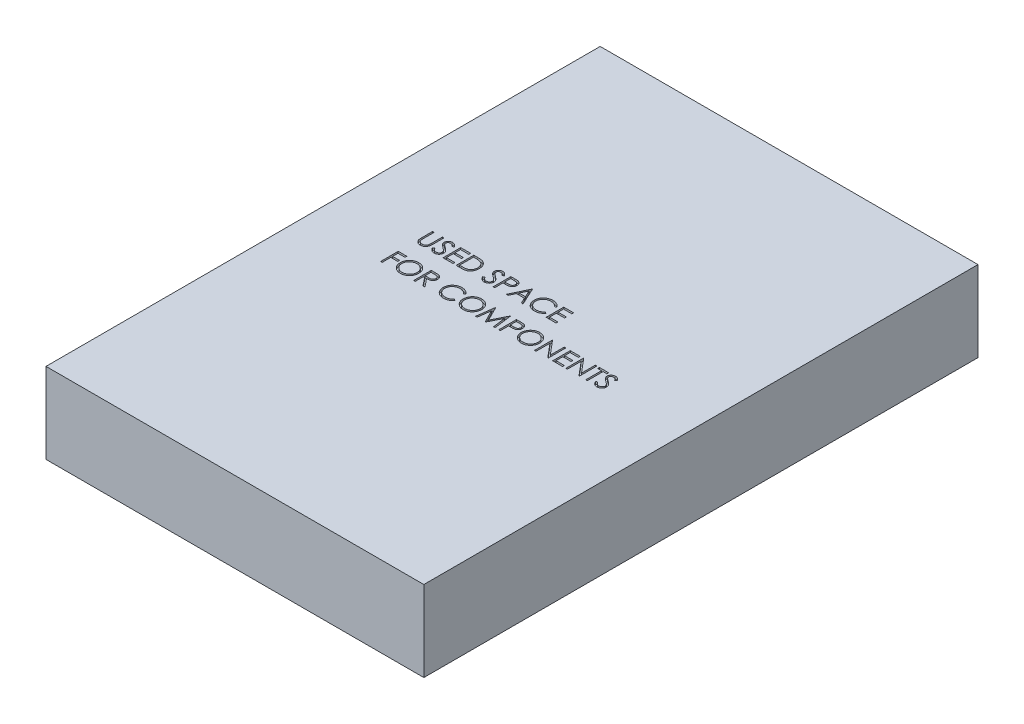
from build123d import *

# Parameters (mm, degrees)
SKETCH1_W           = 75
SKETCH1_H           = 110
BOSS_EXTRUDE1_DEPTH = 16
CUT_EXTRUDE1_DEPTH  = 0.5


with BuildPart() as part:
    # Sketch1 → Boss-Extrude1 (new body)
    with BuildSketch(Plane(origin=(0, 0, 0), x_dir=(1, 0, 0), z_dir=(0, 1, 0))):
        with Locations((37.5, 55)):
            Rectangle(SKETCH1_W, SKETCH1_H)
    extrude(amount=BOSS_EXTRUDE1_DEPTH)

    # Sketch2 → Cut-Extrude1 (cut)
    # profile 1 of 22: a face of its own
    with BuildSketch(Plane(origin=(0, 16, 0), x_dir=(1, 0, 0), z_dir=(0, 1, 0))):
        with BuildLine():
            Line((15.176761978, 61.574214056), (15.490864542, 61.574214056))
            Line((15.490864542, 61.574214056), (15.490864542, 59.477158768))
            add(Edge.make_bspline(
                [(15.490864542, 59.477158768), (15.490817798, 59.447478032), (15.490729093, 59.391153721), (15.491321607, 59.31098542), (15.492980975, 59.239712961), (15.494027135, 59.177061614), (15.496354468, 59.123318866), (15.498252515, 59.078193556), (15.500693072, 59.041899353), (15.50362619, 59.020718427), (15.504886978, 59.011613896)],
                knots=[0, 0, 0, 0, 1.528628734, 2.90083645, 4.128790002, 5.200304208, 6.127813768, 6.898992206, 7.526736466, 8, 8, 8, 8], degree=3))
            add(Edge.make_bspline(
                [(15.504886978, 59.011613896), (15.510064437, 58.978767132), (15.520127623, 58.914924403), (15.545774001, 58.824016121), (15.581591502, 58.742084663), (15.624034544, 58.666573372), (15.679967156, 58.599584012), (15.746970691, 58.537872359), (15.82814846, 58.483900555), (15.918409065, 58.434549743), (16.015694303, 58.39488466), (16.115105569, 58.364891296), (16.215148548, 58.346612396), (16.282124713, 58.344495857), (16.315383773, 58.343444825)],
                knots=[0, 0, 0, 0, 1.035780045, 2.013197591, 2.933192213, 3.817615948, 4.702609284, 5.640816605, 6.646850145, 7.73207398, 8.84249596, 9.914020372, 10.964143139, 12, 12, 12, 12], degree=3))
            add(Edge.make_bspline(
                [(16.315383773, 58.343444825), (16.343937513, 58.344518676), (16.400880075, 58.346660174), (16.485486506, 58.359921605), (16.567886614, 58.383822171), (16.648487294, 58.414661929), (16.724038279, 58.45540952), (16.794581721, 58.50248036), (16.857545655, 58.557691236), (16.915003653, 58.61879158), (16.965038588, 58.68773138), (17.00840973, 58.763009518), (17.04393566, 58.845758865), (17.061479185, 58.903913287), (17.070491946, 58.933789377)],
                knots=[0, 0, 0, 0, 0.994687771, 1.983630487, 2.973142513, 3.978332533, 4.983357753, 5.956394766, 6.925816176, 7.893390482, 8.871859704, 9.88551698, 10.913711441, 12, 12, 12, 12], degree=3))
            add(Edge.make_bspline(
                [(17.070491946, 58.933789377), (17.073492071, 58.946137951), (17.080177559, 58.973655551), (17.086424604, 59.020176842), (17.09293113, 59.075066206), (17.0974457, 59.138718018), (17.10184692, 59.210918991), (17.104479993, 59.292045248), (17.105697026, 59.381802209), (17.106059706, 59.444439371), (17.106249157, 59.477158768)],
                knots=[0, 0, 0, 0, 0.558680831, 1.244966039, 2.062412453, 2.990489873, 4.051219941, 5.244515665, 6.560634259, 8, 8, 8, 8], degree=3))
            Line((17.106249157, 59.477158768), (17.106249157, 61.574214056))
            Line((17.106249157, 61.574214056), (17.420351721, 61.574214056))
            Line((17.420351721, 61.574214056), (17.420351721, 59.460331845))
            add(Edge.make_bspline(
                [(17.420351721, 59.460331845), (17.420097601, 59.422233466), (17.41960167, 59.347882163), (17.415301093, 59.238930804), (17.408444093, 59.135577822), (17.398756005, 59.037809326), (17.385919002, 58.945975167), (17.371643782, 58.859270398), (17.353464249, 58.778317406), (17.332230847, 58.702484988), (17.307957299, 58.630299475), (17.276516151, 58.56179086), (17.241091651, 58.49487646), (17.199076998, 58.430568352), (17.151865615, 58.368581798), (17.098413935, 58.309292723), (17.040489774, 58.251753677), (16.977130214, 58.197440611), (16.909379689, 58.147631934), (16.837439731, 58.103834163), (16.761862962, 58.066810546), (16.682845835, 58.036334621), (16.600354633, 58.013420022), (16.514387273, 57.996344866), (16.424748079, 57.986642569), (16.363783423, 57.985200639), (16.332911817, 57.984470466)],
                knots=[0, 0, 0, 0, 1.316592851, 2.569410997, 3.76748051, 4.895814652, 5.963796859, 6.97159953, 7.931736103, 8.829262218, 9.692595152, 10.560224239, 11.431080259, 12.30701507, 13.211635791, 14.121146779, 15.063487852, 16.031507147, 17.00238618, 17.966455255, 18.938106653, 19.907068911, 20.888905087, 21.893141452, 22.933117798, 24, 24, 24, 24], degree=3))
            add(Edge.make_bspline(
                [(16.332911817, 57.984470466), (16.299242715, 57.985255232), (16.233184056, 57.986794938), (16.135845989, 57.995617688), (16.042531792, 58.012236083), (15.952255915, 58.033396026), (15.866247418, 58.062579764), (15.783353974, 58.096677889), (15.704995293, 58.138555149), (15.629900164, 58.185148542), (15.560075408, 58.23757318), (15.495978005, 58.294713354), (15.437502134, 58.355653731), (15.385633438, 58.421054097), (15.339512553, 58.490405804), (15.29978234, 58.563905044), (15.265669096, 58.64152336), (15.248062529, 58.695476561), (15.239161817, 58.722751716)],
                knots=[0, 0, 0, 0, 1.13879206, 2.234305948, 3.301075583, 4.341971843, 5.366689343, 6.369221514, 7.369726634, 8.367512178, 9.355451585, 10.318319045, 11.268648973, 12.207971039, 13.137398894, 14.081662264, 15.030215811, 16, 16, 16, 16], degree=3))
            add(Edge.make_bspline(
                [(15.239161817, 58.722751716), (15.233984659, 58.741384291), (15.222755288, 58.78179876), (15.21072999, 58.848685248), (15.200620909, 58.925700166), (15.19111535, 59.012848784), (15.185506392, 59.110198651), (15.180588954, 59.217707567), (15.176727335, 59.335505528), (15.176750107, 59.417560044), (15.176761978, 59.460331845)],
                knots=[0, 0, 0, 0, 0.625038921, 1.35572334, 2.194682327, 3.136881307, 4.189498639, 5.346923369, 6.617055217, 8, 8, 8, 8], degree=3))
            Line((15.176761978, 59.460331845), (15.176761978, 61.574214056))
        make_face()
    # profile 2 of 22: a face of its own
    with BuildSketch(Plane(origin=(0, 16, 0), x_dir=(1, 0, 0), z_dir=(0, 1, 0))):
        with BuildLine():
            Line((17.95881326, 58.749394345), (18.254686657, 58.926778159))
            add(Edge.make_bspline(
                [(18.254686657, 58.926778159), (18.282204894, 58.880713774), (18.334928775, 58.79245619), (18.422880134, 58.673198149), (18.514013045, 58.571835993), (18.609002379, 58.488959385), (18.707268327, 58.423710498), (18.809452381, 58.377508267), (18.915210192, 58.348692291), (18.987184013, 58.345192205), (19.023116144, 58.343444825)],
                knots=[0, 0, 0, 0, 1.272034388, 2.437168799, 3.508375237, 4.49857839, 5.41946034, 6.295179144, 7.148887113, 8, 8, 8, 8], degree=3))
            add(Edge.make_bspline(
                [(19.023116144, 58.343444825), (19.053803005, 58.344299498), (19.114639778, 58.345993888), (19.204202021, 58.36227469), (19.291183823, 58.387286819), (19.373792461, 58.423107751), (19.450888075, 58.466446236), (19.518494771, 58.518792414), (19.576940884, 58.57739862), (19.624749999, 58.642781274), (19.661430034, 58.713098423), (19.689622102, 58.785274374), (19.705267176, 58.860442942), (19.707623929, 58.911053405), (19.70881326, 58.936593864)],
                knots=[0, 0, 0, 0, 1.095163259, 2.171163733, 3.241058638, 4.321873601, 5.38011039, 6.391990106, 7.366004449, 8.327778327, 9.272591725, 10.192022065, 11.087607919, 12, 12, 12, 12], degree=3))
            add(Edge.make_bspline(
                [(19.70881326, 58.936593864), (19.707338949, 58.965734713), (19.704341891, 59.024973803), (19.679010411, 59.112373456), (19.639161164, 59.198866026), (19.60239852, 59.252367291), (19.583312459, 59.280143543)],
                knots=[0, 0, 0, 0, 0.938893495, 1.908633276, 2.914225137, 4, 4, 4, 4], degree=3))
            add(Edge.make_bspline(
                [(19.583312459, 59.280143543), (19.567641844, 59.300190367), (19.53474335, 59.342276165), (19.478185837, 59.404921401), (19.411819723, 59.46953982), (19.337916168, 59.538598877), (19.253783079, 59.608886673), (19.162055565, 59.683754951), (19.060391706, 59.760356528), (18.989092209, 59.811729094), (18.952302843, 59.838236492)],
                knots=[0, 0, 0, 0, 0.722233717, 1.516239348, 2.393582979, 3.351407094, 4.387010283, 5.505090956, 6.712668013, 8, 8, 8, 8], degree=3))
            add(Edge.make_bspline(
                [(18.952302843, 59.838236492), (18.915478847, 59.86446508), (18.84507417, 59.914612142), (18.746615588, 59.989036426), (18.658571125, 60.057080295), (18.581332108, 60.119384308), (18.514932512, 60.175956912), (18.458849101, 60.226254851), (18.414510544, 60.271638412), (18.389854963, 60.301079754), (18.378785215, 60.314298191)],
                knots=[0, 0, 0, 0, 1.452282411, 2.77665338, 3.964542531, 5.026858415, 5.96415736, 6.766646006, 7.446254459, 8, 8, 8, 8], degree=3))
            add(Edge.make_bspline(
                [(18.378785215, 60.314298191), (18.36331267, 60.334899228), (18.332883833, 60.375413931), (18.292717828, 60.438738789), (18.258578665, 60.503562054), (18.231816333, 60.570057919), (18.209280114, 60.637292848), (18.194122183, 60.706144094), (18.184630786, 60.776302712), (18.1836588, 60.823516213), (18.183172234, 60.847150755)],
                knots=[0, 0, 0, 0, 1.068054152, 2.10047183, 3.106115577, 4.101338837, 5.06977816, 6.043150881, 7.020423561, 8, 8, 8, 8], degree=3))
            add(Edge.make_bspline(
                [(18.183172234, 60.847150755), (18.184477443, 60.884180529), (18.187059963, 60.957448593), (18.20890048, 61.064479424), (18.243373374, 61.166665841), (18.291668262, 61.262996174), (18.353925615, 61.350962155), (18.425971589, 61.431575642), (18.511783076, 61.499344225), (18.605935699, 61.558556283), (18.708992071, 61.604902208), (18.816982974, 61.639863188), (18.930080046, 61.659672446), (19.006683181, 61.662515211), (19.045552042, 61.663957646)],
                knots=[0, 0, 0, 0, 1.005424448, 1.989358655, 2.955360095, 3.929531133, 4.905563448, 5.876582895, 6.856512386, 7.866279853, 8.892233794, 9.918561126, 10.94386622, 12, 12, 12, 12], degree=3))
            add(Edge.make_bspline(
                [(19.045552042, 61.663957646), (19.086796142, 61.662535094), (19.168817494, 61.659706093), (19.289466709, 61.635108562), (19.405627426, 61.59440789), (19.499070691, 61.548219232), (19.572203452, 61.502087816), (19.627976185, 61.460067992), (19.684493636, 61.411692883), (19.74221169, 61.356833637), (19.80015235, 61.294986886), (19.859175802, 61.226576197), (19.919420071, 61.152019642), (19.958175931, 61.098795141), (19.978044029, 61.071509729)],
                knots=[0, 0, 0, 0, 1.286793592, 2.559021753, 3.825965368, 5.121522368, 5.803751409, 6.523245864, 7.299691795, 8.125521123, 9.008227632, 9.944561021, 10.946284179, 12, 12, 12, 12], degree=3))
            Line((19.978044029, 61.071509729), (19.694089702, 60.856265338))
            add(Edge.make_bspline(
                [(19.694089702, 60.856265338), (19.67694377, 60.878354029), (19.643924713, 60.920891682), (19.593795226, 60.980462997), (19.546546578, 61.034879477), (19.499996178, 61.082144605), (19.456602547, 61.124846738), (19.414485504, 61.161406495), (19.374251153, 61.192182091), (19.323534242, 61.225025651), (19.259816524, 61.257582154), (19.179831988, 61.285131232), (19.096245713, 61.301686294), (19.039316081, 61.303875182), (19.010495952, 61.304983287)],
                knots=[0, 0, 0, 0, 1.181633172, 2.275549214, 3.290209073, 4.226197932, 5.078386478, 5.862611352, 6.581680152, 7.217281963, 8.414376989, 9.595101626, 10.782541182, 12, 12, 12, 12], degree=3))
            add(Edge.make_bspline(
                [(19.010495952, 61.304983287), (18.97433943, 61.303771587), (18.904614982, 61.301434938), (18.805624746, 61.275914952), (18.716530821, 61.235733092), (18.639978256, 61.179418114), (18.576241279, 61.112697121), (18.53013582, 61.035918266), (18.502385656, 60.951135864), (18.498999376, 60.891994207), (18.497274798, 60.861874312)],
                knots=[0, 0, 0, 0, 1.14458467, 2.207223713, 3.21896685, 4.227309161, 5.202851033, 6.127160689, 7.046193047, 8, 8, 8, 8], degree=3))
            add(Edge.make_bspline(
                [(18.497274798, 60.861874312), (18.497667925, 60.843122834), (18.498454821, 60.805589215), (18.509429619, 60.750137793), (18.523528948, 60.694826453), (18.545871579, 60.63990387), (18.576716883, 60.584409511), (18.617222059, 60.527387774), (18.668235371, 60.468336065), (18.707312383, 60.429928691), (18.727943869, 60.409650755)],
                knots=[0, 0, 0, 0, 0.858281714, 1.717966888, 2.583508476, 3.4729293, 4.427298488, 5.488583878, 6.674047936, 8, 8, 8, 8], degree=3))
            add(Edge.make_bspline(
                [(18.727943869, 60.409650755), (18.735605241, 60.402813729), (18.753806908, 60.386570521), (18.787082834, 60.35997824), (18.831025632, 60.327175468), (18.884487833, 60.286588151), (18.948455195, 60.239506689), (19.022934751, 60.186533077), (19.107096284, 60.125947618), (19.1668182, 60.083590077), (19.198396593, 60.061193223)],
                knots=[0, 0, 0, 0, 0.420754252, 0.999615792, 1.744751191, 2.668019286, 3.750313428, 4.999500688, 6.413464383, 8, 8, 8, 8], degree=3))
            add(Edge.make_bspline(
                [(19.198396593, 60.061193223), (19.236382506, 60.033551863), (19.309936963, 59.980028201), (19.414594543, 59.899612521), (19.509488351, 59.820964753), (19.594951554, 59.744587146), (19.671828463, 59.671059053), (19.739266183, 59.599495872), (19.797951864, 59.5304103), (19.861131082, 59.441837724), (19.925688902, 59.33305664), (19.981130409, 59.199778401), (20.016088757, 59.065982081), (20.020660272, 58.976055244), (20.022915824, 58.931686011)],
                knots=[0, 0, 0, 0, 1.163667725, 2.253281268, 3.268753668, 4.215851969, 5.092017293, 5.902905408, 6.650798638, 7.335211899, 8.59617414, 9.77448103, 10.901945474, 12, 12, 12, 12], degree=3))
            add(Edge.make_bspline(
                [(20.022915824, 58.931686011), (20.022258686, 58.900307646), (20.020957171, 58.838160263), (20.005996257, 58.746905186), (19.984076592, 58.658274316), (19.951039358, 58.573363204), (19.9107162, 58.490618441), (19.859549952, 58.41221054), (19.800242267, 58.336404142), (19.732208502, 58.265220651), (19.6577626, 58.199874455), (19.579078905, 58.141745393), (19.496028632, 58.09327707), (19.409062315, 58.053726228), (19.318159979, 58.02279271), (19.223352195, 58.000379841), (19.124482684, 57.98662413), (19.057282202, 57.985196369), (19.023116144, 57.984470466)],
                knots=[0, 0, 0, 0, 0.983748083, 1.948392443, 2.894712957, 3.844097841, 4.80183111, 5.778335162, 6.776009319, 7.81870978, 8.863265674, 9.881300176, 10.883814829, 11.87499822, 12.874611388, 13.892143829, 14.928324115, 16, 16, 16, 16], degree=3))
            add(Edge.make_bspline(
                [(19.023116144, 57.984470466), (18.996680801, 57.984981648), (18.944143041, 57.985997573), (18.866433559, 57.994978854), (18.79029397, 58.007685957), (18.716679688, 58.027860027), (18.644642277, 58.052337004), (18.574495042, 58.082475337), (18.506203988, 58.118592538), (18.439386405, 58.159887563), (18.374212231, 58.207945308), (18.311292763, 58.263918804), (18.248563577, 58.326264309), (18.187876181, 58.396674872), (18.128003037, 58.474012955), (18.070124627, 58.559002139), (18.013042909, 58.651179492), (17.977227442, 58.716044578), (17.95881326, 58.749394345)],
                knots=[0, 0, 0, 0, 0.915332311, 1.819136955, 2.706846663, 3.586547465, 4.459518054, 5.340707479, 6.227863349, 7.133153174, 8.059268498, 9.028702269, 10.047606654, 11.120612155, 12.245963614, 13.433783089, 14.680604001, 16, 16, 16, 16], degree=3))
        make_face()
    # profile 3 of 22: a face of its own
    with BuildSketch(Plane(origin=(0, 16, 0), x_dir=(1, 0, 0), z_dir=(0, 1, 0))):
        Polygon((20.740864542, 61.574214056), (22.715223516, 61.574214056), (22.715223516, 61.215239697), (21.054967106, 61.215239697), (21.054967106, 60.13831662), (22.715223516, 60.13831662), (22.715223516, 59.779342261), (21.054967106, 59.779342261), (21.054967106, 58.433188415), (22.715223516, 58.433188415), (22.715223516, 58.074214056), (20.740864542, 58.074214056), align=None)
    # profile 4 of 22: a face of its own
    with BuildSketch(Plane(origin=(0, 16, 0), x_dir=(1, 0, 0), z_dir=(0, 1, 0))):
        with BuildLine():
            Line((23.343428644, 58.074214056), (23.343428644, 61.574214056))
            Line((23.343428644, 61.574214056), (24.050159414, 61.574214056))
            add(Edge.make_bspline(
                [(24.050159414, 61.574214056), (24.111628402, 61.573771486), (24.230386167, 61.572916443), (24.401998615, 61.567495052), (24.560782377, 61.557904586), (24.706215236, 61.54393506), (24.838696448, 61.526782026), (24.957855056, 61.505281622), (25.064307199, 61.479893452), (25.12977664, 61.458248001), (25.160736337, 61.448012133)],
                knots=[0, 0, 0, 0, 1.314313732, 2.53924729, 3.670748893, 4.714932338, 5.66265055, 6.526160246, 7.303039223, 8, 8, 8, 8], degree=3))
            add(Edge.make_bspline(
                [(25.160736337, 61.448012133), (25.201231076, 61.432581427), (25.281302268, 61.402069933), (25.395309391, 61.344513632), (25.502634754, 61.27930053), (25.603853899, 61.206344668), (25.696654725, 61.123580319), (25.784662622, 61.034523233), (25.864277346, 60.935934893), (25.937185642, 60.829859905), (26.002921301, 60.717547853), (26.060060459, 60.599212744), (26.107514452, 60.475455536), (26.146907679, 60.346620388), (26.177954136, 60.21242401), (26.199136068, 60.072710144), (26.213107058, 59.928030955), (26.214511109, 59.829856491), (26.215223516, 59.780043383)],
                knots=[0, 0, 0, 0, 0.984719456, 1.947108742, 2.898477687, 3.838006223, 4.779231079, 5.722358779, 6.681677486, 7.655904652, 8.64651281, 9.637519902, 10.640069247, 11.656948941, 12.698408672, 13.768548281, 14.867775369, 16, 16, 16, 16], degree=3))
            add(Edge.make_bspline(
                [(26.215223516, 59.780043383), (26.214594549, 59.736782145), (26.213355103, 59.651531356), (26.202225787, 59.52589046), (26.186049467, 59.403976889), (26.161005269, 59.286371189), (26.130602755, 59.172042971), (26.091638604, 59.062210726), (26.047003108, 58.955866917), (25.994953229, 58.854449441), (25.937811844, 58.758366069), (25.876490101, 58.667790541), (25.811053406, 58.584015319), (25.740877773, 58.506786707), (25.666870056, 58.436221128), (25.588545726, 58.371729113), (25.505702675, 58.314572558), (25.418711952, 58.26250545), (25.325035823, 58.217085094), (25.222899957, 58.178655085), (25.111868779, 58.146808469), (24.992214822, 58.120237574), (24.863731344, 58.099160271), (24.726292378, 58.085033878), (24.580109089, 58.075480946), (24.479729824, 58.074644552), (24.428064061, 58.074214056)],
                knots=[0, 0, 0, 0, 1.105936401, 2.179363191, 3.223086493, 4.248585256, 5.251745608, 6.245858792, 7.225916811, 8.198733463, 9.158002045, 10.082870192, 10.993790845, 11.873723703, 12.748670949, 13.606408763, 14.465103618, 15.319838547, 16.196477973, 17.123216899, 18.106603292, 19.147568657, 20.255746949, 21.433717677, 22.679120308, 24, 24, 24, 24], degree=3))
            Line((24.428064061, 58.074214056), (23.343428644, 58.074214056))
        make_face()
        with BuildLine():
            Line((23.657531209, 58.433188415), (24.059273997, 58.433188415))
            add(Edge.make_bspline(
                [(24.059273997, 58.433188415), (24.117002368, 58.433436511), (24.228035166, 58.433913692), (24.387693163, 58.438100895), (24.53357256, 58.444942832), (24.665694069, 58.45451791), (24.783983094, 58.467186525), (24.888686843, 58.481311428), (24.979462102, 58.498908879), (25.034391539, 58.514859838), (25.059774798, 58.522230883)],
                knots=[0, 0, 0, 0, 1.375205317, 2.645023457, 3.804390687, 4.853969522, 5.800190428, 6.637939096, 7.370582563, 8, 8, 8, 8], degree=3))
            add(Edge.make_bspline(
                [(25.059774798, 58.522230883), (25.09172316, 58.533482441), (25.154856799, 58.555716814), (25.245737884, 58.596274476), (25.330494888, 58.644316545), (25.410604914, 58.697718819), (25.484931569, 58.758364821), (25.554355685, 58.82493581), (25.618737487, 58.897770585), (25.677411795, 58.976778747), (25.729920099, 59.061468543), (25.775391328, 59.151007376), (25.81524286, 59.244414186), (25.846521452, 59.343123345), (25.871037037, 59.446252403), (25.888401725, 59.553808617), (25.899216449, 59.665771899), (25.900477897, 59.741924023), (25.901120952, 59.780744505)],
                knots=[0, 0, 0, 0, 0.998632004, 1.973411704, 2.929992603, 3.868527914, 4.809262121, 5.754881198, 6.702106254, 7.672490631, 8.653608572, 9.636854334, 10.631411391, 11.644891563, 12.686317036, 13.754757253, 14.855430412, 16, 16, 16, 16], degree=3))
            add(Edge.make_bspline(
                [(25.901120952, 59.780744505), (25.900607665, 59.821677985), (25.899599307, 59.902092169), (25.886924997, 60.020082865), (25.868403441, 60.133563515), (25.841619755, 60.242541711), (25.807488876, 60.347230063), (25.764894235, 60.447049573), (25.716227615, 60.543054442), (25.658324278, 60.633028808), (25.594908685, 60.718121917), (25.524530806, 60.796076832), (25.448308767, 60.867071133), (25.367073918, 60.932210445), (25.278536819, 60.988874121), (25.184783128, 61.039560802), (25.084437457, 61.082576694), (25.014624761, 61.105455556), (24.979145792, 61.117082646)],
                knots=[0, 0, 0, 0, 1.122418816, 2.205001699, 3.251619955, 4.274784885, 5.280384055, 6.268708349, 7.249350384, 8.229342522, 9.199999885, 10.157847722, 11.105861043, 12.055065948, 13.010012805, 13.98527497, 14.976112212, 16, 16, 16, 16], degree=3))
            add(Edge.make_bspline(
                [(24.979145792, 61.117082646), (24.949794645, 61.125199074), (24.887386055, 61.142456826), (24.785546591, 61.161282199), (24.670931442, 61.177886698), (24.543031741, 61.191944737), (24.401993282, 61.202032058), (24.247707594, 61.209603373), (24.080107989, 61.214710006), (23.963925455, 61.215058713), (23.903624959, 61.215239697)],
                knots=[0, 0, 0, 0, 0.674548936, 1.434276114, 2.292660221, 3.240891867, 4.284742987, 5.42552168, 6.663806718, 8, 8, 8, 8], degree=3))
            Line((23.903624959, 61.215239697), (23.657531209, 61.215239697))
            Line((23.657531209, 61.215239697), (23.657531209, 58.433188415))
        make_face(mode=Mode.SUBTRACT)
    # profile 5 of 22: a face of its own
    with BuildSketch(Plane(origin=(0, 16, 0), x_dir=(1, 0, 0), z_dir=(0, 1, 0))):
        with BuildLine():
            Line((27.920351721, 58.749394345), (28.216225119, 58.926778159))
            add(Edge.make_bspline(
                [(28.216225119, 58.926778159), (28.243743356, 58.880713774), (28.296467237, 58.79245619), (28.384418596, 58.673198149), (28.475551507, 58.571835993), (28.570540841, 58.488959385), (28.668806789, 58.423710498), (28.770990842, 58.377508267), (28.876748653, 58.348692291), (28.948722475, 58.345192205), (28.984654606, 58.343444825)],
                knots=[0, 0, 0, 0, 1.272034388, 2.437168799, 3.508375237, 4.49857839, 5.41946034, 6.295179144, 7.148887113, 8, 8, 8, 8], degree=3))
            add(Edge.make_bspline(
                [(28.984654606, 58.343444825), (29.015341466, 58.344299498), (29.076178239, 58.345993888), (29.165740482, 58.36227469), (29.252722285, 58.387286819), (29.335330922, 58.423107751), (29.412426537, 58.466446236), (29.480033232, 58.518792414), (29.538479346, 58.57739862), (29.58628846, 58.642781274), (29.622968495, 58.713098423), (29.651160564, 58.785274374), (29.666805637, 58.860442942), (29.669162391, 58.911053405), (29.670351721, 58.936593864)],
                knots=[0, 0, 0, 0, 1.095163259, 2.171163733, 3.241058638, 4.321873601, 5.38011039, 6.391990106, 7.366004449, 8.327778327, 9.272591725, 10.192022065, 11.087607919, 12, 12, 12, 12], degree=3))
            add(Edge.make_bspline(
                [(29.670351721, 58.936593864), (29.668877411, 58.965734713), (29.665880352, 59.024973803), (29.640548872, 59.112373456), (29.600699625, 59.198866026), (29.563936982, 59.252367291), (29.54485092, 59.280143543)],
                knots=[0, 0, 0, 0, 0.938893495, 1.908633276, 2.914225137, 4, 4, 4, 4], degree=3))
            add(Edge.make_bspline(
                [(29.54485092, 59.280143543), (29.529180306, 59.300190367), (29.496281812, 59.342276165), (29.439724299, 59.404921401), (29.373358185, 59.46953982), (29.29945463, 59.538598877), (29.215321541, 59.608886673), (29.123594027, 59.683754951), (29.021930168, 59.760356528), (28.950630671, 59.811729094), (28.913841305, 59.838236492)],
                knots=[0, 0, 0, 0, 0.722233717, 1.516239348, 2.393582979, 3.351407094, 4.387010283, 5.505090956, 6.712668013, 8, 8, 8, 8], degree=3))
            add(Edge.make_bspline(
                [(28.913841305, 59.838236492), (28.877017308, 59.86446508), (28.806612632, 59.914612142), (28.70815405, 59.989036426), (28.620109587, 60.057080295), (28.54287057, 60.119384308), (28.476470973, 60.175956912), (28.420387562, 60.226254851), (28.376049005, 60.271638412), (28.351393424, 60.301079754), (28.340323676, 60.314298191)],
                knots=[0, 0, 0, 0, 1.452282411, 2.77665338, 3.964542531, 5.026858415, 5.96415736, 6.766646006, 7.446254459, 8, 8, 8, 8], degree=3))
            add(Edge.make_bspline(
                [(28.340323676, 60.314298191), (28.324851131, 60.334899228), (28.294422295, 60.375413931), (28.254256289, 60.438738789), (28.220117126, 60.503562054), (28.193354794, 60.570057919), (28.170818575, 60.637292848), (28.155660645, 60.706144094), (28.146169248, 60.776302712), (28.145197261, 60.823516213), (28.144710696, 60.847150755)],
                knots=[0, 0, 0, 0, 1.068054152, 2.10047183, 3.106115577, 4.101338837, 5.06977816, 6.043150881, 7.020423561, 8, 8, 8, 8], degree=3))
            add(Edge.make_bspline(
                [(28.144710696, 60.847150755), (28.146015905, 60.884180529), (28.148598425, 60.957448593), (28.170438942, 61.064479424), (28.204911836, 61.166665841), (28.253206724, 61.262996174), (28.315464076, 61.350962155), (28.387510051, 61.431575642), (28.473321537, 61.499344225), (28.56747416, 61.558556283), (28.670530532, 61.604902208), (28.778521436, 61.639863188), (28.891618508, 61.659672446), (28.968221642, 61.662515211), (29.007090503, 61.663957646)],
                knots=[0, 0, 0, 0, 1.005424448, 1.989358655, 2.955360095, 3.929531133, 4.905563448, 5.876582895, 6.856512386, 7.866279853, 8.892233794, 9.918561126, 10.94386622, 12, 12, 12, 12], degree=3))
            add(Edge.make_bspline(
                [(29.007090503, 61.663957646), (29.048334604, 61.662535094), (29.130355955, 61.659706093), (29.251005171, 61.635108562), (29.367165887, 61.59440789), (29.460609152, 61.548219232), (29.533741914, 61.502087816), (29.589514646, 61.460067992), (29.646032097, 61.411692883), (29.703750152, 61.356833637), (29.761690811, 61.294986886), (29.820714264, 61.226576197), (29.880958532, 61.152019642), (29.919714393, 61.098795141), (29.939582491, 61.071509729)],
                knots=[0, 0, 0, 0, 1.286793592, 2.559021753, 3.825965368, 5.121522368, 5.803751409, 6.523245864, 7.299691795, 8.125521123, 9.008227632, 9.944561021, 10.946284179, 12, 12, 12, 12], degree=3))
            Line((29.939582491, 61.071509729), (29.655628164, 60.856265338))
            add(Edge.make_bspline(
                [(29.655628164, 60.856265338), (29.638482231, 60.878354029), (29.605463174, 60.920891682), (29.555333687, 60.980462997), (29.508085039, 61.034879477), (29.46153464, 61.082144605), (29.418141008, 61.124846738), (29.376023966, 61.161406495), (29.335789615, 61.192182091), (29.285072704, 61.225025651), (29.221354986, 61.257582154), (29.141370449, 61.285131232), (29.057784174, 61.301686294), (29.000854543, 61.303875182), (28.972034414, 61.304983287)],
                knots=[0, 0, 0, 0, 1.181633172, 2.275549214, 3.290209073, 4.226197932, 5.078386478, 5.862611352, 6.581680152, 7.217281963, 8.414376989, 9.595101626, 10.782541182, 12, 12, 12, 12], degree=3))
            add(Edge.make_bspline(
                [(28.972034414, 61.304983287), (28.935877891, 61.303771587), (28.866153444, 61.301434938), (28.767163208, 61.275914952), (28.678069283, 61.235733092), (28.601516718, 61.179418114), (28.537779741, 61.112697121), (28.491674282, 61.035918266), (28.463924117, 60.951135864), (28.460537838, 60.891994207), (28.45881326, 60.861874312)],
                knots=[0, 0, 0, 0, 1.14458467, 2.207223713, 3.21896685, 4.227309161, 5.202851033, 6.127160689, 7.046193047, 8, 8, 8, 8], degree=3))
            add(Edge.make_bspline(
                [(28.45881326, 60.861874312), (28.459206386, 60.843122834), (28.459993283, 60.805589215), (28.47096808, 60.750137793), (28.485067409, 60.694826453), (28.507410041, 60.63990387), (28.538255345, 60.584409511), (28.57876052, 60.527387774), (28.629773832, 60.468336065), (28.668850845, 60.429928691), (28.68948233, 60.409650755)],
                knots=[0, 0, 0, 0, 0.858281714, 1.717966888, 2.583508476, 3.4729293, 4.427298488, 5.488583878, 6.674047936, 8, 8, 8, 8], degree=3))
            add(Edge.make_bspline(
                [(28.68948233, 60.409650755), (28.697143703, 60.402813729), (28.71534537, 60.386570521), (28.748621296, 60.35997824), (28.792564094, 60.327175468), (28.846026295, 60.286588151), (28.909993657, 60.239506689), (28.984473213, 60.186533077), (29.068634746, 60.125947618), (29.128356662, 60.083590077), (29.159935055, 60.061193223)],
                knots=[0, 0, 0, 0, 0.420754252, 0.999615792, 1.744751191, 2.668019286, 3.750313428, 4.999500688, 6.413464383, 8, 8, 8, 8], degree=3))
            add(Edge.make_bspline(
                [(29.159935055, 60.061193223), (29.197920968, 60.033551863), (29.271475424, 59.980028201), (29.376133004, 59.899612521), (29.471026812, 59.820964753), (29.556490016, 59.744587146), (29.633366924, 59.671059053), (29.700804645, 59.599495872), (29.759490325, 59.5304103), (29.822669544, 59.441837724), (29.887227363, 59.33305664), (29.942668871, 59.199778401), (29.977627218, 59.065982081), (29.982198734, 58.976055244), (29.984454285, 58.931686011)],
                knots=[0, 0, 0, 0, 1.163667725, 2.253281268, 3.268753668, 4.215851969, 5.092017293, 5.902905408, 6.650798638, 7.335211899, 8.59617414, 9.77448103, 10.901945474, 12, 12, 12, 12], degree=3))
            add(Edge.make_bspline(
                [(29.984454285, 58.931686011), (29.983797147, 58.900307646), (29.982495632, 58.838160263), (29.967534718, 58.746905186), (29.945615053, 58.658274316), (29.912577819, 58.573363204), (29.872254661, 58.490618441), (29.821088413, 58.41221054), (29.761780728, 58.336404142), (29.693746964, 58.265220651), (29.619301061, 58.199874455), (29.540617367, 58.141745393), (29.457567094, 58.09327707), (29.370600777, 58.053726228), (29.27969844, 58.02279271), (29.184890656, 58.000379841), (29.086021145, 57.98662413), (29.018820664, 57.985196369), (28.984654606, 57.984470466)],
                knots=[0, 0, 0, 0, 0.983748083, 1.948392443, 2.894712957, 3.844097841, 4.80183111, 5.778335162, 6.776009319, 7.81870978, 8.863265674, 9.881300176, 10.883814829, 11.87499822, 12.874611388, 13.892143829, 14.928324115, 16, 16, 16, 16], degree=3))
            add(Edge.make_bspline(
                [(28.984654606, 57.984470466), (28.958219263, 57.984981648), (28.905681503, 57.985997573), (28.827972021, 57.994978854), (28.751832432, 58.007685957), (28.67821815, 58.027860027), (28.606180738, 58.052337004), (28.536033504, 58.082475337), (28.46774245, 58.118592538), (28.400924867, 58.159887563), (28.335750692, 58.207945308), (28.272831224, 58.263918804), (28.210102039, 58.326264309), (28.149414643, 58.396674872), (28.089541498, 58.474012955), (28.031663089, 58.559002139), (27.974581371, 58.651179492), (27.938765903, 58.716044578), (27.920351721, 58.749394345)],
                knots=[0, 0, 0, 0, 0.915332311, 1.819136955, 2.706846663, 3.586547465, 4.459518054, 5.340707479, 6.227863349, 7.133153174, 8.059268498, 9.028702269, 10.047606654, 11.120612155, 12.245963614, 13.433783089, 14.680604001, 16, 16, 16, 16], degree=3))
        make_face()
    # profile 6 of 22: a face of its own
    with BuildSketch(Plane(origin=(0, 16, 0), x_dir=(1, 0, 0), z_dir=(0, 1, 0))):
        with BuildLine():
            Line((30.702403003, 61.574214056), (31.388801241, 61.574214056))
            add(Edge.make_bspline(
                [(31.388801241, 61.574214056), (31.436012147, 61.57416216), (31.52647034, 61.574062724), (31.656185395, 61.571047979), (31.773995127, 61.567021286), (31.879645508, 61.561439393), (31.973461606, 61.554842803), (32.055018905, 61.545590764), (32.124958462, 61.535930468), (32.166864911, 61.526109062), (32.185976721, 61.521629921)],
                knots=[0, 0, 0, 0, 1.415646017, 2.712440637, 3.8905458, 4.950247383, 5.884950622, 6.709939814, 7.411656543, 8, 8, 8, 8], degree=3))
            add(Edge.make_bspline(
                [(32.185976721, 61.521629921), (32.210170255, 61.515007972), (32.257987232, 61.50192011), (32.326888275, 61.475706386), (32.392442121, 61.444624221), (32.454873679, 61.409200281), (32.513415762, 61.367914717), (32.568941803, 61.3224411), (32.620961784, 61.271729531), (32.669183176, 61.216348791), (32.713467973, 61.157228581), (32.751597656, 61.093486351), (32.783524883, 61.026195048), (32.810908154, 60.955401477), (32.830616609, 60.880511153), (32.845463509, 60.802044441), (32.854887136, 60.720009751), (32.855789698, 60.663949883), (32.856249157, 60.635411973)],
                knots=[0, 0, 0, 0, 0.999701418, 1.975846123, 2.934577507, 3.890451536, 4.834027766, 5.787354733, 6.749476667, 7.726910423, 8.712836071, 9.690891519, 10.682875813, 11.679750201, 12.712814741, 13.765529915, 14.8625177, 16, 16, 16, 16], degree=3))
            add(Edge.make_bspline(
                [(32.856249157, 60.635411973), (32.855827732, 60.606634196), (32.855003187, 60.550328532), (32.845106901, 60.467955744), (32.83177671, 60.389237354), (32.811279657, 60.314347903), (32.784433984, 60.243732133), (32.752941931, 60.176310901), (32.714958401, 60.113231229), (32.671313571, 60.054264111), (32.622761977, 59.999354199), (32.569509039, 59.948899404), (32.511769746, 59.903195066), (32.449727598, 59.862138722), (32.382777749, 59.826682443), (32.311935596, 59.794925138), (32.236585379, 59.768254077), (32.184442865, 59.754224016), (32.15793185, 59.747090659)],
                knots=[0, 0, 0, 0, 1.121902311, 2.195077645, 3.232258892, 4.234102512, 5.217864754, 6.176164875, 7.132989551, 8.084763148, 9.034132444, 9.988522005, 10.94243251, 11.903244335, 12.886203696, 13.894208494, 14.929344452, 16, 16, 16, 16], degree=3))
            add(Edge.make_bspline(
                [(32.15793185, 59.747090659), (32.136004516, 59.742427678), (32.087949488, 59.732208483), (32.008806766, 59.720800027), (31.91666138, 59.711062426), (31.8116391, 59.703761288), (31.693834195, 59.69751092), (31.563182938, 59.692542826), (31.419428861, 59.689812972), (31.319157617, 59.689672179), (31.266806048, 59.689598671)],
                knots=[0, 0, 0, 0, 0.601384939, 1.31797006, 2.144135048, 3.087295005, 4.142315834, 5.309527816, 6.595305764, 8, 8, 8, 8], degree=3))
            Line((31.266806048, 59.689598671), (31.016505567, 59.689598671))
            Line((31.016505567, 59.689598671), (31.016505567, 58.074214056))
            Line((31.016505567, 58.074214056), (30.702403003, 58.074214056))
            Line((30.702403003, 58.074214056), (30.702403003, 61.574214056))
        make_face()
        with BuildLine():
            Line((31.016505567, 61.215239697), (31.016505567, 60.04857303))
            Line((31.016505567, 60.04857303), (31.629286016, 60.040860691))
            add(Edge.make_bspline(
                [(31.629286016, 60.040860691), (31.659205942, 60.040845227), (31.716965742, 60.040815375), (31.800401965, 60.044800598), (31.877811252, 60.049401131), (31.948955828, 60.056137055), (32.013867762, 60.065658312), (32.072655291, 60.07527005), (32.124862574, 60.089175413), (32.185961776, 60.107898482), (32.254045123, 60.139831097), (32.328112672, 60.186180987), (32.390883258, 60.245261696), (32.445201555, 60.311689527), (32.488307433, 60.385588656), (32.519863425, 60.464657593), (32.538404583, 60.548085443), (32.540890776, 60.605173581), (32.542146593, 60.634009729)],
                knots=[0, 0, 0, 0, 1.160613943, 2.240541288, 3.23993089, 4.169200891, 5.011653406, 5.7853311, 6.478053781, 7.106038997, 8.262395093, 9.384106736, 10.481365981, 11.59014053, 12.70357646, 13.786202915, 14.881775077, 16, 16, 16, 16], degree=3))
            add(Edge.make_bspline(
                [(32.542146593, 60.634009729), (32.540883947, 60.662148243), (32.538373962, 60.718084125), (32.519718099, 60.800062885), (32.488368785, 60.87829859), (32.44491219, 60.951271675), (32.39217106, 61.017460479), (32.330871717, 61.074957606), (32.261158456, 61.121179309), (32.196310225, 61.151012591), (32.138709039, 61.169227866), (32.088677079, 61.181972706), (32.032186404, 61.192148313), (31.969218625, 61.200387815), (31.900261791, 61.207441277), (31.824723476, 61.212227254), (31.742889833, 61.21502871), (31.686079262, 61.215167665), (31.656629766, 61.215239697)],
                knots=[0, 0, 0, 0, 1.120700087, 2.227813068, 3.331159281, 4.466773991, 5.599788987, 6.693661531, 7.80175334, 8.91857717, 9.525282508, 10.207424825, 10.974604443, 11.810962634, 12.737642355, 13.736264703, 14.826523623, 16, 16, 16, 16], degree=3))
            Line((31.656629766, 61.215239697), (31.016505567, 61.215239697))
        make_face(mode=Mode.SUBTRACT)
    # profile 7 of 22: a face of its own
    with BuildSketch(Plane(origin=(0, 16, 0), x_dir=(1, 0, 0), z_dir=(0, 1, 0))):
        Polygon((35.010095311, 61.574214056), (36.625479926, 58.074214056), (36.284033612, 58.074214056), (35.766605728, 59.196008928), (34.179967106, 59.196008928), (33.647815664, 58.074214056), (33.304967106, 58.074214056), (34.965223516, 61.574214056), align=None)
        Polygon((34.984153805, 60.89202255), (34.350339702, 59.554983287), (35.601140984, 59.554983287), align=None, mode=Mode.SUBTRACT)
    # profile 8 of 22: a face of its own
    with BuildSketch(Plane(origin=(0, 16, 0), x_dir=(1, 0, 0), z_dir=(0, 1, 0))):
        with BuildLine():
            Line((40.484454285, 60.931986492), (40.209614542, 60.721649954))
            add(Edge.make_bspline(
                [(40.209614542, 60.721649954), (40.190008653, 60.745015923), (40.151061207, 60.791432839), (40.088402004, 60.856612384), (40.023100361, 60.917677645), (39.95518124, 60.974919525), (39.883422121, 61.02633629), (39.809561322, 61.074607393), (39.732363277, 61.117875131), (39.625611542, 61.170338117), (39.485963694, 61.225084272), (39.310168855, 61.270987504), (39.126657756, 61.300208679), (39.001460157, 61.303373521), (38.937779606, 61.304983287)],
                knots=[0, 0, 0, 0, 0.757959112, 1.505699292, 2.245454638, 2.979532153, 3.711538275, 4.438200793, 5.171680507, 5.909471876, 7.393775596, 8.890124382, 10.418191784, 12, 12, 12, 12], degree=3))
            add(Edge.make_bspline(
                [(38.937779606, 61.304983287), (38.902696307, 61.304579324), (38.832855314, 61.303775148), (38.729206841, 61.293166023), (38.627493789, 61.278254813), (38.527782323, 61.25612949), (38.430199365, 61.228156871), (38.334106963, 61.194731457), (38.240896363, 61.153376617), (38.149278125, 61.107668357), (38.061498914, 61.056040912), (37.978443866, 60.999727561), (37.900415898, 60.939358464), (37.827353286, 60.874707358), (37.759181337, 60.806065397), (37.696394027, 60.732701056), (37.639208616, 60.654848882), (37.586491591, 60.573535475), (37.539278858, 60.488997683), (37.499748979, 60.400922613), (37.464743856, 60.310818509), (37.437044614, 60.217667349), (37.415120097, 60.122124583), (37.399992434, 60.023933795), (37.389503962, 59.923300115), (37.388703785, 59.855090803), (37.388300439, 59.820708447)],
                knots=[0, 0, 0, 0, 1.054917814, 2.100044995, 3.131103042, 4.146048494, 5.169673617, 6.183595914, 7.203665975, 8.234915748, 9.262203917, 10.264457458, 11.251630812, 12.227803204, 13.197192746, 14.159520551, 15.12972552, 16.100847026, 17.073214652, 18.039054194, 19.002613845, 19.979014051, 20.95965708, 21.949030935, 22.966165397, 24, 24, 24, 24], degree=3))
            add(Edge.make_bspline(
                [(37.388300439, 59.820708447), (37.389562258, 59.768977127), (37.392039673, 59.667409542), (37.414088007, 59.518638932), (37.447593098, 59.376118258), (37.497808675, 59.240738416), (37.559727725, 59.110830058), (37.637968337, 58.988591204), (37.728584874, 58.87217464), (37.832859294, 58.764331692), (37.94726511, 58.665817967), (38.070013021, 58.579067385), (38.200797309, 58.506752503), (38.338173939, 58.446576556), (38.483200053, 58.400319829), (38.635614856, 58.367755705), (38.795086851, 58.346513524), (38.904056251, 58.344479836), (38.959514382, 58.343444825)],
                knots=[0, 0, 0, 0, 1.029171465, 2.020641659, 2.987623507, 3.938342917, 4.889210282, 5.84687017, 6.821220943, 7.821438502, 8.827599549, 9.822697543, 10.807740252, 11.797342354, 12.80366471, 13.83203677, 14.896651826, 16, 16, 16, 16], degree=3))
            add(Edge.make_bspline(
                [(38.959514382, 58.343444825), (39.020617071, 58.345133605), (39.140881779, 58.348457528), (39.317249806, 58.376616777), (39.486085571, 58.422274695), (39.647398158, 58.486172617), (39.800732804, 58.569237905), (39.946329465, 58.669935782), (40.084311035, 58.789224115), (40.167282317, 58.880307243), (40.209614542, 58.926778159)],
                knots=[0, 0, 0, 0, 1.028121516, 2.023589091, 2.998037872, 3.967518031, 4.937445131, 5.927275754, 6.942489185, 8, 8, 8, 8], degree=3))
            Line((40.209614542, 58.926778159), (40.484454285, 58.718544986))
            add(Edge.make_bspline(
                [(40.484454285, 58.718544986), (40.462336176, 58.690006534), (40.4182059, 58.633066327), (40.346747883, 58.552794618), (40.271470586, 58.477290582), (40.191814876, 58.407162961), (40.108697084, 58.341008495), (40.020624772, 58.280706664), (39.928755739, 58.22541578), (39.833401261, 58.174788855), (39.734662648, 58.129871608), (39.632658213, 58.09141784), (39.527827637, 58.058292951), (39.420166129, 58.031041014), (39.309450372, 58.00976993), (39.196079898, 57.995550255), (39.079810023, 57.985808341), (39.001368602, 57.984920425), (38.961617747, 57.984470466)],
                knots=[0, 0, 0, 0, 0.986787822, 1.968848986, 2.935600012, 3.899624008, 4.868462664, 5.837806735, 6.815139263, 7.798259679, 8.787526145, 9.778297419, 10.776456485, 11.791383307, 12.812564526, 13.85620153, 14.913611965, 16, 16, 16, 16], degree=3))
            add(Edge.make_bspline(
                [(38.961617747, 57.984470466), (38.92397408, 57.984732459), (38.84953839, 57.985250517), (38.739639638, 57.993642684), (38.632650057, 58.005092421), (38.528875432, 58.022332552), (38.427749456, 58.042676892), (38.330188872, 58.069948149), (38.235233662, 58.100497315), (38.143265321, 58.136402302), (38.054205621, 58.176918485), (37.96834181, 58.222710044), (37.885713377, 58.273391908), (37.805507957, 58.327846919), (37.728910373, 58.387824221), (37.655256847, 58.452490855), (37.584134371, 58.521628866), (37.540131686, 58.571483719), (37.518007971, 58.596549793)],
                knots=[0, 0, 0, 0, 1.114604814, 2.203992996, 3.262667896, 4.300477797, 5.318619304, 6.316056647, 7.298880507, 8.271930387, 9.238335007, 10.195173496, 11.151986948, 12.108099108, 13.064862484, 14.031167946, 15.010108607, 16, 16, 16, 16], degree=3))
            add(Edge.make_bspline(
                [(37.518007971, 58.596549793), (37.482572328, 58.640090982), (37.412128851, 58.726647693), (37.322003167, 58.866933674), (37.244855612, 59.013401883), (37.182479691, 59.166821812), (37.133716958, 59.326849199), (37.099935763, 59.493564713), (37.077984159, 59.666812655), (37.07547387, 59.784649444), (37.074197875, 59.844546588)],
                knots=[0, 0, 0, 0, 0.994628077, 1.977248131, 2.950237994, 3.925870899, 4.908910175, 5.911660606, 6.938484602, 8, 8, 8, 8], degree=3))
            add(Edge.make_bspline(
                [(37.074197875, 59.844546588), (37.075753069, 59.907502042), (37.078812815, 60.031362966), (37.10480861, 60.21313692), (37.146627407, 60.387288318), (37.206024295, 60.553492063), (37.281329647, 60.712622343), (37.37435626, 60.863463548), (37.484023403, 61.006980348), (37.60947097, 61.140995099), (37.747038306, 61.263534452), (37.894357119, 61.371340655), (38.051139066, 61.461058171), (38.215656918, 61.536054334), (38.3891426, 61.593698797), (38.571225969, 61.634051984), (38.761564884, 61.6591691), (38.891427309, 61.662344308), (38.957411016, 61.663957646)],
                knots=[0, 0, 0, 0, 1.032925535, 2.032216505, 3.007276963, 3.968222605, 4.92396291, 5.891752235, 6.871517503, 7.883894988, 8.900124299, 9.891468569, 10.874487609, 11.85992873, 12.854644235, 13.869047385, 14.917252991, 16, 16, 16, 16], degree=3))
            add(Edge.make_bspline(
                [(38.957411016, 61.663957646), (38.997625488, 61.663475508), (39.077225985, 61.662521164), (39.194978638, 61.653215022), (39.309620965, 61.637701415), (39.421231947, 61.616585345), (39.530354563, 61.590378024), (39.636154804, 61.556237726), (39.739253491, 61.517201194), (39.839000399, 61.472242728), (39.934916949, 61.421775987), (40.026973268, 61.366360363), (40.114438126, 61.306064558), (40.197926975, 61.241401383), (40.276043186, 61.171002823), (40.351004664, 61.096805227), (40.420265743, 61.016671403), (40.463018938, 60.960266469), (40.484454285, 60.931986492)],
                knots=[0, 0, 0, 0, 1.096760587, 2.17092713, 3.219439832, 4.250915756, 5.268269357, 6.278326846, 7.281116186, 8.274029601, 9.260640565, 10.235837813, 11.203064059, 12.156899882, 13.114053108, 14.069676657, 15.032185724, 16, 16, 16, 16], degree=3))
        make_face()
    # profile 9 of 22: a face of its own
    with BuildSketch(Plane(origin=(0, 16, 0), x_dir=(1, 0, 0), z_dir=(0, 1, 0))):
        Polygon((41.202403003, 61.574214056), (43.176761978, 61.574214056), (43.176761978, 61.215239697), (41.516505567, 61.215239697), (41.516505567, 60.13831662), (43.176761978, 60.13831662), (43.176761978, 59.779342261), (41.516505567, 59.779342261), (41.516505567, 58.433188415), (43.176761978, 58.433188415), (43.176761978, 58.074214056), (41.202403003, 58.074214056), align=None)
    # profile 10 of 22: a face of its own
    with BuildSketch(Plane(origin=(0, 16, 0), x_dir=(1, 0, 0), z_dir=(0, 1, 0))):
        Polygon((15.176761978, 54.740880723), (16.881890183, 54.740880723), (16.881890183, 54.381906364), (15.490864542, 54.381906364), (15.490864542, 53.304983287), (16.881890183, 53.304983287), (16.881890183, 52.946008928), (15.490864542, 52.946008928), (15.490864542, 51.240880723), (15.176761978, 51.240880723), align=None)
    # profile 11 of 22: a face of its own
    with BuildSketch(Plane(origin=(0, 16, 0), x_dir=(1, 0, 0), z_dir=(0, 1, 0))):
        with BuildLine():
            add(Edge.make_bspline(
                [(19.147915824, 54.830624312), (19.21272393, 54.828982833), (19.340012397, 54.825758832), (19.527087294, 54.801079729), (19.70568239, 54.758384339), (19.877252529, 54.701521356), (20.039745505, 54.625666971), (20.194384398, 54.533981822), (20.340801271, 54.425505364), (20.477022653, 54.301076137), (20.601679603, 54.165692683), (20.71150549, 54.021214773), (20.803547783, 53.868515971), (20.87913357, 53.70805514), (20.93843218, 53.540195172), (20.979351224, 53.364041169), (21.005489374, 53.180734479), (21.008545151, 53.055707614), (21.010095311, 52.992282966)],
                knots=[0, 0, 0, 0, 1.065120563, 2.091984664, 3.0946048, 4.079830382, 5.057816894, 6.036188127, 7.030412546, 8.04752943, 9.064399622, 10.05169764, 11.02544977, 11.989514704, 12.962713494, 13.945757189, 14.957906945, 16, 16, 16, 16], degree=3))
            add(Edge.make_bspline(
                [(21.010095311, 52.992282966), (21.008545379, 52.92932552), (21.005490282, 52.8052291), (20.979321504, 52.623085655), (20.938280504, 52.447994959), (20.879684238, 52.280249306), (20.80445876, 52.119671742), (20.711803589, 51.966684788), (20.602662378, 51.82123829), (20.478455527, 51.684925625), (20.343054485, 51.559928154), (20.197824218, 51.451009278), (20.046030898, 51.357285154), (19.88572119, 51.28250148), (19.719021153, 51.222729559), (19.54443883, 51.181976929), (19.362792276, 51.155689886), (19.238921272, 51.15267137), (19.175960696, 51.151137133)],
                knots=[0, 0, 0, 0, 1.043624062, 2.057103931, 3.04512605, 4.022047818, 4.998200453, 5.980619268, 6.982898556, 8.009068085, 9.034988726, 10.034168286, 11.015286542, 11.987931943, 12.962482838, 13.94673481, 14.956375938, 16, 16, 16, 16], degree=3))
            add(Edge.make_bspline(
                [(19.175960696, 51.151137133), (19.112536377, 51.15268652), (18.987510161, 51.155740774), (18.803973125, 51.181922179), (18.627695382, 51.222863482), (18.45918103, 51.281372919), (18.298336101, 51.356990149), (18.144846018, 51.449194528), (17.999326871, 51.55860167), (17.862985124, 51.682768244), (17.738235926, 51.817939796), (17.62947655, 51.962774051), (17.537251437, 52.114429508), (17.461888105, 52.273327032), (17.402223645, 52.438698475), (17.361518827, 52.611646952), (17.335182875, 52.791186458), (17.332148029, 52.913429356), (17.330608132, 52.975456043)],
                knots=[0, 0, 0, 0, 1.053102029, 2.075944431, 3.073151272, 4.055350789, 5.033113405, 6.020478099, 7.024410459, 8.052272461, 9.079885166, 10.07527673, 11.055994387, 12.023226415, 12.992069828, 13.970394897, 14.97016774, 16, 16, 16, 16], degree=3))
            add(Edge.make_bspline(
                [(17.330608132, 52.975456043), (17.331142767, 53.017088712), (17.332205293, 53.099828836), (17.344996986, 53.222695436), (17.363558687, 53.343586094), (17.3901606, 53.462157042), (17.424952267, 53.578118026), (17.466004294, 53.692268789), (17.516144139, 53.803452513), (17.572824787, 53.912195905), (17.636086595, 54.016803811), (17.705962345, 54.115683394), (17.779997713, 54.209664391), (17.861161107, 54.296311394), (17.946777552, 54.378145051), (18.03823593, 54.453907768), (18.134978175, 54.524282719), (18.237420554, 54.58770306), (18.343038829, 54.645062194), (18.451915607, 54.694284045), (18.562572179, 54.736530107), (18.675526827, 54.770770932), (18.790479599, 54.797802968), (18.907681383, 54.816210322), (19.027038809, 54.82903464), (19.107450128, 54.830092142), (19.147915824, 54.830624312)],
                knots=[0, 0, 0, 0, 1.037015668, 2.060948919, 3.074880161, 4.083647147, 5.086022904, 6.090072063, 7.104153813, 8.122640571, 9.144368836, 10.147691507, 11.138137339, 12.123020368, 13.103399296, 14.087645067, 15.080126199, 16.082011238, 17.087798457, 18.072939717, 19.057185487, 20.037253025, 21.01195951, 21.997135196, 22.992090687, 24, 24, 24, 24], degree=3))
        make_face()
        with BuildLine():
            add(Edge.make_bspline(
                [(19.163340503, 54.471649954), (19.13012587, 54.471245063), (19.064014137, 54.470439154), (18.965729601, 54.459823438), (18.868737667, 54.444693549), (18.773018305, 54.423112028), (18.678972015, 54.393707975), (18.585722174, 54.359867067), (18.49411912, 54.318645977), (18.404465262, 54.272073272), (18.317550187, 54.220524351), (18.235537486, 54.163552584), (18.158214842, 54.10249403), (18.085771575, 54.037206193), (18.018420403, 53.967356591), (17.954835702, 53.894004155), (17.89756612, 53.815052264), (17.845080543, 53.732641857), (17.798112703, 53.646880276), (17.756347348, 53.558670414), (17.722183339, 53.467292727), (17.694320963, 53.373738569), (17.671221152, 53.27815611), (17.656587228, 53.179820261), (17.645854869, 53.079225149), (17.645095023, 53.011243295), (17.644710696, 52.976858287)],
                knots=[0, 0, 0, 0, 1.008559885, 2.007477868, 2.99961109, 3.989939068, 4.984837346, 5.991145699, 7.001802488, 8.033829008, 9.059044045, 10.069351652, 11.065060232, 12.050310815, 13.029377138, 14.011219647, 14.996725999, 15.989392538, 16.977580475, 17.965360261, 18.951710183, 19.937753436, 20.929683414, 21.935841486, 22.955955122, 24, 24, 24, 24], degree=3))
            add(Edge.make_bspline(
                [(17.644710696, 52.976858287), (17.645985558, 52.926296066), (17.648493606, 52.826824536), (17.670451176, 52.681056392), (17.70427315, 52.540968106), (17.754130517, 52.407326196), (17.816481131, 52.278981913), (17.893508021, 52.157073809), (17.984767107, 52.041568934), (18.088430634, 51.933273665), (18.20175334, 51.834427861), (18.32208607, 51.747664453), (18.448139678, 51.674254203), (18.58024288, 51.61444913), (18.717690419, 51.567059393), (18.86136797, 51.534580761), (19.01031843, 51.513205306), (19.111849085, 51.51115255), (19.163340503, 51.510111492)],
                knots=[0, 0, 0, 0, 1.032063989, 2.030389145, 3.003944642, 3.970395727, 4.937377036, 5.913328081, 6.909231446, 7.93887556, 8.970685674, 9.976071282, 10.964166581, 11.944589148, 12.933237628, 13.927779006, 14.949070134, 16, 16, 16, 16], degree=3))
            add(Edge.make_bspline(
                [(19.163340503, 51.510111492), (19.197950005, 51.510586996), (19.266591041, 51.511530064), (19.368686564, 51.521028741), (19.468942775, 51.536260611), (19.567219055, 51.558191266), (19.663403867, 51.585638473), (19.75789867, 51.618246201), (19.84969696, 51.658927404), (19.939956798, 51.703875356), (20.02635304, 51.755115513), (20.108828572, 51.810153663), (20.185304552, 51.871122284), (20.257693623, 51.935440096), (20.325321312, 52.004403944), (20.387730296, 52.077924166), (20.444710429, 52.156464823), (20.497176075, 52.238750229), (20.543979338, 52.324746482), (20.584758437, 52.41327616), (20.619354553, 52.504121269), (20.647283058, 52.59741284), (20.669168519, 52.692973689), (20.684248439, 52.790931767), (20.694796878, 52.89109111), (20.695591955, 52.958834966), (20.695992747, 52.992984088)],
                knots=[0, 0, 0, 0, 1.047197238, 2.076906641, 3.100256066, 4.114471768, 5.12198147, 6.126382909, 7.136867548, 8.15857795, 9.17633901, 10.174870724, 11.156907918, 12.133735059, 13.104061851, 14.077631395, 15.04955518, 16.038496417, 17.029181396, 18.010275684, 18.986308667, 19.968651475, 20.955262928, 21.950658345, 22.966943676, 24, 24, 24, 24], degree=3))
            add(Edge.make_bspline(
                [(20.695992747, 52.992984088), (20.695591634, 53.026899592), (20.694795953, 53.094177243), (20.684253478, 53.193638061), (20.669152588, 53.290891272), (20.647389879, 53.385555075), (20.619339726, 53.4776536), (20.584752395, 53.567100348), (20.543967096, 53.654228543), (20.497158871, 53.73882284), (20.444543048, 53.819997578), (20.387048805, 53.897599991), (20.323683457, 53.970172732), (20.256257432, 54.039507426), (20.183086546, 54.104125316), (20.104502252, 54.164047836), (20.021458575, 54.220721111), (19.933531339, 54.271846673), (19.842787385, 54.319060905), (19.749673427, 54.359511908), (19.655244328, 54.393884028), (19.559740215, 54.423200993), (19.462357237, 54.444609023), (19.363753408, 54.459837073), (19.26406515, 54.470435459), (19.19702193, 54.471243837), (19.163340503, 54.471649954)],
                knots=[0, 0, 0, 0, 1.02996197, 2.043119294, 3.035359645, 4.018872909, 4.991431989, 5.957985074, 6.929999688, 7.912076566, 8.892894881, 9.867085534, 10.843653904, 11.817741046, 12.803660682, 13.806313499, 14.818574707, 15.856120519, 16.894564902, 17.924820532, 18.937903209, 19.946497019, 20.957711757, 21.963978472, 22.977135795, 24, 24, 24, 24], degree=3))
        make_face(mode=Mode.SUBTRACT)
    # profile 12 of 22: a face of its own
    with BuildSketch(Plane(origin=(0, 16, 0), x_dir=(1, 0, 0), z_dir=(0, 1, 0))):
        with BuildLine():
            Line((21.728044029, 54.740880723), (22.428464702, 54.740880723))
            add(Edge.make_bspline(
                [(22.428464702, 54.740880723), (22.475205831, 54.740725137), (22.564953975, 54.740426394), (22.693527245, 54.738760632), (22.810354342, 54.733986276), (22.915374182, 54.729877692), (23.008584837, 54.722385751), (23.090272127, 54.715225104), (23.160059825, 54.705851443), (23.202305676, 54.69714602), (23.221433452, 54.693204441)],
                knots=[0, 0, 0, 0, 1.410062039, 2.707475311, 3.878576406, 4.937260626, 5.877586885, 6.699081471, 7.410979367, 8, 8, 8, 8], degree=3))
            add(Edge.make_bspline(
                [(23.221433452, 54.693204441), (23.247040076, 54.686877675), (23.297707066, 54.674359112), (23.370657132, 54.647899511), (23.440171456, 54.617279886), (23.50596128, 54.581316166), (23.567697071, 54.539741386), (23.626015382, 54.493273264), (23.681180845, 54.442166058), (23.730962476, 54.385131217), (23.777901527, 54.325294707), (23.817490154, 54.26059095), (23.851616633, 54.192929422), (23.87878715, 54.121622005), (23.900665124, 54.047360233), (23.916091363, 53.969471436), (23.925342551, 53.888310461), (23.926284407, 53.832952552), (23.926761978, 53.804883127)],
                knots=[0, 0, 0, 0, 1.027469482, 2.033020251, 3.019912614, 3.986113645, 4.951240523, 5.91722682, 6.890402269, 7.87763091, 8.8651537, 9.85103654, 10.82876324, 11.815024772, 12.821070561, 13.842952187, 14.906261191, 16, 16, 16, 16], degree=3))
            add(Edge.make_bspline(
                [(23.926761978, 53.804883127), (23.92529298, 53.758248022), (23.922426584, 53.667250854), (23.89570148, 53.535189973), (23.85192496, 53.412000658), (23.791601671, 53.29783802), (23.714782196, 53.194927375), (23.622457405, 53.104536919), (23.514575793, 53.028897007), (23.414146477, 52.976444202), (23.325432277, 52.942851294), (23.252398965, 52.919214935), (23.172731987, 52.900952969), (23.087194653, 52.884592838), (22.995430997, 52.872241143), (22.897660958, 52.863194549), (22.793814806, 52.8575405), (22.722475737, 52.856698495), (22.685776401, 52.856265338)],
                knots=[0, 0, 0, 0, 1.260483769, 2.459530307, 3.627416485, 4.787058657, 5.939039949, 7.08810263, 8.267026773, 9.491475466, 10.141966685, 10.831826277, 11.566392101, 12.351337768, 13.187381173, 14.07005841, 15.007169909, 16, 16, 16, 16], degree=3))
            Line((22.685776401, 52.856265338), (23.971633773, 51.240880723))
            Line((23.971633773, 51.240880723), (23.583212298, 51.240880723))
            Line((23.583212298, 51.240880723), (22.297354926, 52.856265338))
            Line((22.297354926, 52.856265338), (22.042146593, 52.856265338))
            Line((22.042146593, 52.856265338), (22.042146593, 51.240880723))
            Line((22.042146593, 51.240880723), (21.728044029, 51.240880723))
            Line((21.728044029, 51.240880723), (21.728044029, 54.740880723))
        make_face()
        with BuildLine():
            Line((22.042146593, 54.381906364), (22.042146593, 53.215239697))
            Line((22.042146593, 53.215239697), (22.682971914, 53.210331845))
            add(Edge.make_bspline(
                [(22.682971914, 53.210331845), (22.712891953, 53.210318608), (22.77088551, 53.210292951), (22.854786174, 53.214286728), (22.932906286, 53.218830046), (23.004947038, 53.225779392), (23.070940614, 53.234735463), (23.130854027, 53.245938447), (23.184785079, 53.25899051), (23.247683617, 53.279192136), (23.317920149, 53.311198154), (23.394251608, 53.357763653), (23.459253946, 53.416332772), (23.514171808, 53.483306228), (23.55830124, 53.556942477), (23.589413294, 53.636358846), (23.609155737, 53.719550444), (23.611484282, 53.776728552), (23.612659414, 53.805584248)],
                knots=[0, 0, 0, 0, 1.146690395, 2.22261258, 3.21895312, 4.145990853, 4.996080663, 5.770904154, 6.481378293, 7.121626537, 8.300444488, 9.431385265, 10.535395872, 11.636531494, 12.74115979, 13.810798291, 14.895190096, 16, 16, 16, 16], degree=3))
            add(Edge.make_bspline(
                [(23.612659414, 53.805584248), (23.611457293, 53.833730822), (23.609075127, 53.889507061), (23.589626359, 53.971162971), (23.556736977, 54.048229921), (23.512414739, 54.120394406), (23.458415584, 54.185900142), (23.395097772, 54.241947295), (23.324192577, 54.28819676), (23.257921378, 54.31775114), (23.198687166, 54.335870994), (23.147257506, 54.348622157), (23.089146028, 54.358866626), (23.024070569, 54.367074687), (22.952308939, 54.374129631), (22.873498287, 54.37888141), (22.788161507, 54.381695274), (22.729014576, 54.381834363), (22.698396593, 54.381906364)],
                knots=[0, 0, 0, 0, 1.101028733, 2.181837193, 3.264309656, 4.369019818, 5.486613113, 6.575447106, 7.666700264, 8.788928104, 9.402425223, 10.0903467, 10.862060571, 11.710948788, 12.657782767, 13.684531032, 14.801375019, 16, 16, 16, 16], degree=3))
            Line((22.698396593, 54.381906364), (22.042146593, 54.381906364))
        make_face(mode=Mode.SUBTRACT)
    # profile 13 of 22: a face of its own
    with BuildSketch(Plane(origin=(0, 16, 0), x_dir=(1, 0, 0), z_dir=(0, 1, 0))):
        with BuildLine():
            Line((29.266505567, 54.098653159), (28.991665824, 53.88831662))
            add(Edge.make_bspline(
                [(28.991665824, 53.88831662), (28.972059936, 53.91168259), (28.933112489, 53.958099506), (28.870453286, 54.02327905), (28.805151643, 54.084344312), (28.737232522, 54.141586191), (28.665473403, 54.193002957), (28.591612604, 54.24127406), (28.514414559, 54.284541798), (28.407662824, 54.337004784), (28.268014976, 54.391750939), (28.092220137, 54.43765417), (27.908709038, 54.466875346), (27.783511439, 54.470040187), (27.719830888, 54.471649954)],
                knots=[0, 0, 0, 0, 0.757959112, 1.505699292, 2.245454638, 2.979532153, 3.711538275, 4.438200793, 5.171680507, 5.909471876, 7.393775596, 8.890124382, 10.418191784, 12, 12, 12, 12], degree=3))
            add(Edge.make_bspline(
                [(27.719830888, 54.471649954), (27.684747589, 54.471245991), (27.614906596, 54.470441815), (27.511258123, 54.45983269), (27.409545071, 54.44492148), (27.309833605, 54.422796157), (27.212250647, 54.394823538), (27.116158245, 54.361398124), (27.022947645, 54.320043284), (26.931329407, 54.274335024), (26.843550196, 54.222707579), (26.760495148, 54.166394227), (26.68246718, 54.106025131), (26.609404568, 54.041374024), (26.541232619, 53.972732064), (26.478445309, 53.899367722), (26.421259898, 53.821515549), (26.368542873, 53.740202141), (26.32133014, 53.65566435), (26.281800261, 53.567589279), (26.246795138, 53.477485176), (26.219095896, 53.384334015), (26.197171379, 53.288791249), (26.182043716, 53.190600462), (26.171555244, 53.089966782), (26.170755068, 53.021757469), (26.170351721, 52.987375114)],
                knots=[0, 0, 0, 0, 1.054917814, 2.100044995, 3.131103042, 4.146048494, 5.169673617, 6.183595914, 7.203665975, 8.234915748, 9.262203917, 10.264457458, 11.251630812, 12.227803204, 13.197192746, 14.159520551, 15.12972552, 16.100847026, 17.073214652, 18.039054194, 19.002613845, 19.979014051, 20.95965708, 21.949030935, 22.966165397, 24, 24, 24, 24], degree=3))
            add(Edge.make_bspline(
                [(26.170351721, 52.987375114), (26.17161354, 52.935643794), (26.174090955, 52.834076209), (26.196139289, 52.685305598), (26.22964438, 52.542784925), (26.279859957, 52.407405082), (26.341779007, 52.277496724), (26.420019619, 52.155257871), (26.510636156, 52.038841306), (26.614910576, 51.930998359), (26.729316392, 51.832484633), (26.852064303, 51.745734052), (26.982848591, 51.673419169), (27.120225221, 51.613243223), (27.265251335, 51.566986495), (27.417666138, 51.534422372), (27.577138133, 51.513180191), (27.686107533, 51.511146503), (27.741565664, 51.510111492)],
                knots=[0, 0, 0, 0, 1.029171465, 2.020641659, 2.987623507, 3.938342917, 4.889210282, 5.84687017, 6.821220943, 7.821438502, 8.827599549, 9.822697543, 10.807740252, 11.797342354, 12.80366471, 13.83203677, 14.896651826, 16, 16, 16, 16], degree=3))
            add(Edge.make_bspline(
                [(27.741565664, 51.510111492), (27.802668353, 51.511800272), (27.922933062, 51.515124194), (28.099301088, 51.543283443), (28.268136854, 51.588941361), (28.42944944, 51.652839284), (28.582784086, 51.735904571), (28.728380747, 51.836602449), (28.866362317, 51.955890782), (28.949333599, 52.04697391), (28.991665824, 52.093444825)],
                knots=[0, 0, 0, 0, 1.028121516, 2.023589091, 2.998037872, 3.967518031, 4.937445131, 5.927275754, 6.942489185, 8, 8, 8, 8], degree=3))
            Line((28.991665824, 52.093444825), (29.266505567, 51.885211652))
            add(Edge.make_bspline(
                [(29.266505567, 51.885211652), (29.244387458, 51.8566732), (29.200257182, 51.799732994), (29.128799165, 51.719461284), (29.053521868, 51.643957249), (28.973866158, 51.573829628), (28.890748366, 51.507675162), (28.802676054, 51.447373331), (28.710807022, 51.392082446), (28.615452543, 51.341455522), (28.51671393, 51.296538275), (28.414709495, 51.258084507), (28.309878919, 51.224959618), (28.202217411, 51.197707681), (28.091501654, 51.176436597), (27.97813118, 51.162216922), (27.861861305, 51.152475008), (27.783419884, 51.151587092), (27.743669029, 51.151137133)],
                knots=[0, 0, 0, 0, 0.986787822, 1.968848986, 2.935600012, 3.899624008, 4.868462664, 5.837806735, 6.815139263, 7.798259679, 8.787526145, 9.778297419, 10.776456485, 11.791383307, 12.812564526, 13.85620153, 14.913611965, 16, 16, 16, 16], degree=3))
            add(Edge.make_bspline(
                [(27.743669029, 51.151137133), (27.706025362, 51.151399126), (27.631589672, 51.151917183), (27.52169092, 51.160309351), (27.414701339, 51.171759088), (27.310926714, 51.188999219), (27.209800739, 51.209343559), (27.112240154, 51.236614815), (27.017284944, 51.267163982), (26.925316603, 51.303068969), (26.836256903, 51.343585151), (26.750393092, 51.38937671), (26.667764659, 51.440058575), (26.587559239, 51.494513585), (26.510961655, 51.554490887), (26.43730813, 51.619157522), (26.366185653, 51.688295532), (26.322182968, 51.738150386), (26.300059253, 51.76321646)],
                knots=[0, 0, 0, 0, 1.114604814, 2.203992996, 3.262667896, 4.300477797, 5.318619304, 6.316056647, 7.298880507, 8.271930387, 9.238335007, 10.195173496, 11.151986948, 12.108099108, 13.064862484, 14.031167946, 15.010108607, 16, 16, 16, 16], degree=3))
            add(Edge.make_bspline(
                [(26.300059253, 51.76321646), (26.26462361, 51.806757649), (26.194180133, 51.893314359), (26.104054449, 52.033600341), (26.026906894, 52.180068549), (25.964530974, 52.333488478), (25.91576824, 52.493515865), (25.881987045, 52.66023138), (25.860035441, 52.833479322), (25.857525152, 52.951316111), (25.856249157, 53.011213255)],
                knots=[0, 0, 0, 0, 0.994628077, 1.977248131, 2.950237994, 3.925870899, 4.908910175, 5.911660606, 6.938484602, 8, 8, 8, 8], degree=3))
            add(Edge.make_bspline(
                [(25.856249157, 53.011213255), (25.857804351, 53.074168708), (25.860864097, 53.198029633), (25.886859892, 53.379803586), (25.928678689, 53.553954985), (25.988075577, 53.72015873), (26.063380929, 53.87928901), (26.156407542, 54.030130215), (26.266074685, 54.173647014), (26.391522252, 54.307661766), (26.529089588, 54.430201118), (26.676408402, 54.538007322), (26.833190348, 54.627724838), (26.9977082, 54.702721), (27.171193882, 54.760365464), (27.353277251, 54.80071865), (27.543616166, 54.825835767), (27.673478591, 54.829010974), (27.739462298, 54.830624312)],
                knots=[0, 0, 0, 0, 1.032925535, 2.032216505, 3.007276963, 3.968222605, 4.92396291, 5.891752235, 6.871517503, 7.883894988, 8.900124299, 9.891468569, 10.874487609, 11.85992873, 12.854644235, 13.869047385, 14.917252991, 16, 16, 16, 16], degree=3))
            add(Edge.make_bspline(
                [(27.739462298, 54.830624312), (27.77967677, 54.830142174), (27.859277267, 54.82918783), (27.97702992, 54.819881688), (28.091672247, 54.804368082), (28.203283229, 54.783252012), (28.312405845, 54.757044691), (28.418206086, 54.722904392), (28.521304773, 54.683867861), (28.621051681, 54.638909395), (28.716968231, 54.588442654), (28.80902455, 54.53302703), (28.896489408, 54.472731225), (28.979978257, 54.408068049), (29.058094468, 54.33766949), (29.133055946, 54.263471894), (29.202317025, 54.18333807), (29.24507022, 54.126933136), (29.266505567, 54.098653159)],
                knots=[0, 0, 0, 0, 1.096760587, 2.17092713, 3.219439832, 4.250915756, 5.268269357, 6.278326846, 7.281116186, 8.274029601, 9.260640565, 10.235837813, 11.203064059, 12.156899882, 13.114053108, 14.069676657, 15.032185724, 16, 16, 16, 16], degree=3))
        make_face()
    # profile 14 of 22: a face of its own
    with BuildSketch(Plane(origin=(0, 16, 0), x_dir=(1, 0, 0), z_dir=(0, 1, 0))):
        with BuildLine():
            add(Edge.make_bspline(
                [(31.622274798, 54.830624312), (31.687082904, 54.828982833), (31.814371371, 54.825758832), (32.001446269, 54.801079729), (32.180041364, 54.758384339), (32.351611503, 54.701521356), (32.514104479, 54.625666971), (32.668743372, 54.533981822), (32.815160246, 54.425505364), (32.951381627, 54.301076137), (33.076038578, 54.165692683), (33.185864464, 54.021214773), (33.277906758, 53.868515971), (33.353492545, 53.70805514), (33.412791154, 53.540195172), (33.453710198, 53.364041169), (33.479848348, 53.180734479), (33.482904126, 53.055707614), (33.484454285, 52.992282966)],
                knots=[0, 0, 0, 0, 1.065120563, 2.091984664, 3.0946048, 4.079830382, 5.057816894, 6.036188127, 7.030412546, 8.04752943, 9.064399622, 10.05169764, 11.02544977, 11.989514704, 12.962713494, 13.945757189, 14.957906945, 16, 16, 16, 16], degree=3))
            add(Edge.make_bspline(
                [(33.484454285, 52.992282966), (33.482904353, 52.92932552), (33.479849256, 52.8052291), (33.453680479, 52.623085655), (33.412639479, 52.447994959), (33.354043213, 52.280249306), (33.278817734, 52.119671742), (33.186162563, 51.966684788), (33.077021352, 51.82123829), (32.952814501, 51.684925625), (32.817413459, 51.559928154), (32.672183192, 51.451009278), (32.520389873, 51.357285154), (32.360080164, 51.28250148), (32.193380128, 51.222729559), (32.018797804, 51.181976929), (31.83715125, 51.155689886), (31.713280247, 51.15267137), (31.65031967, 51.151137133)],
                knots=[0, 0, 0, 0, 1.043624062, 2.057103931, 3.04512605, 4.022047818, 4.998200453, 5.980619268, 6.982898556, 8.009068085, 9.034988726, 10.034168286, 11.015286542, 11.987931943, 12.962482838, 13.94673481, 14.956375938, 16, 16, 16, 16], degree=3))
            add(Edge.make_bspline(
                [(31.65031967, 51.151137133), (31.586895351, 51.15268652), (31.461869135, 51.155740774), (31.2783321, 51.181922179), (31.102054356, 51.222863482), (30.933540005, 51.281372919), (30.772695075, 51.356990149), (30.619204992, 51.449194528), (30.473685845, 51.55860167), (30.337344099, 51.682768244), (30.2125949, 51.817939796), (30.103835525, 51.962774051), (30.011610411, 52.114429508), (29.936247079, 52.273327032), (29.87658262, 52.438698475), (29.835877801, 52.611646952), (29.809541849, 52.791186458), (29.806507003, 52.913429356), (29.804967106, 52.975456043)],
                knots=[0, 0, 0, 0, 1.053102029, 2.075944431, 3.073151272, 4.055350789, 5.033113405, 6.020478099, 7.024410459, 8.052272461, 9.079885166, 10.07527673, 11.055994387, 12.023226415, 12.992069828, 13.970394897, 14.97016774, 16, 16, 16, 16], degree=3))
            add(Edge.make_bspline(
                [(29.804967106, 52.975456043), (29.805501741, 53.017088712), (29.806564268, 53.099828836), (29.81935596, 53.222695436), (29.837917661, 53.343586094), (29.864519574, 53.462157042), (29.899311241, 53.578118026), (29.940363268, 53.692268789), (29.990503114, 53.803452513), (30.047183762, 53.912195905), (30.11044557, 54.016803811), (30.180321319, 54.115683394), (30.254356688, 54.209664391), (30.335520081, 54.296311394), (30.421136527, 54.378145051), (30.512594905, 54.453907768), (30.609337149, 54.524282719), (30.711779529, 54.58770306), (30.817397804, 54.645062194), (30.926274581, 54.694284045), (31.036931153, 54.736530107), (31.149885801, 54.770770932), (31.264838573, 54.797802968), (31.382040358, 54.816210322), (31.501397784, 54.82903464), (31.581809103, 54.830092142), (31.622274798, 54.830624312)],
                knots=[0, 0, 0, 0, 1.037015668, 2.060948919, 3.074880161, 4.083647147, 5.086022904, 6.090072063, 7.104153813, 8.122640571, 9.144368836, 10.147691507, 11.138137339, 12.123020368, 13.103399296, 14.087645067, 15.080126199, 16.082011238, 17.087798457, 18.072939717, 19.057185487, 20.037253025, 21.01195951, 21.997135196, 22.992090687, 24, 24, 24, 24], degree=3))
        make_face()
        with BuildLine():
            add(Edge.make_bspline(
                [(31.637699478, 54.471649954), (31.604484844, 54.471245063), (31.538373111, 54.470439154), (31.440088575, 54.459823438), (31.343096641, 54.444693549), (31.247377279, 54.423112028), (31.15333099, 54.393707975), (31.060081148, 54.359867067), (30.968478095, 54.318645977), (30.878824237, 54.272073272), (30.791909162, 54.220524351), (30.70989646, 54.163552584), (30.632573816, 54.10249403), (30.56013055, 54.037206193), (30.492779377, 53.967356591), (30.429194676, 53.894004155), (30.371925094, 53.815052264), (30.319439517, 53.732641857), (30.272471677, 53.646880276), (30.230706322, 53.558670414), (30.196542314, 53.467292727), (30.168679937, 53.373738569), (30.145580126, 53.27815611), (30.130946202, 53.179820261), (30.120213843, 53.079225149), (30.119453997, 53.011243295), (30.11906967, 52.976858287)],
                knots=[0, 0, 0, 0, 1.008559885, 2.007477868, 2.99961109, 3.989939068, 4.984837346, 5.991145699, 7.001802488, 8.033829008, 9.059044045, 10.069351652, 11.065060232, 12.050310815, 13.029377138, 14.011219647, 14.996725999, 15.989392538, 16.977580475, 17.965360261, 18.951710183, 19.937753436, 20.929683414, 21.935841486, 22.955955122, 24, 24, 24, 24], degree=3))
            add(Edge.make_bspline(
                [(30.11906967, 52.976858287), (30.120344532, 52.926296066), (30.12285258, 52.826824536), (30.14481015, 52.681056392), (30.178632124, 52.540968106), (30.228489491, 52.407326196), (30.290840106, 52.278981913), (30.367866996, 52.157073809), (30.459126081, 52.041568934), (30.562789608, 51.933273665), (30.676112315, 51.834427861), (30.796445044, 51.747664453), (30.922498652, 51.674254203), (31.054601855, 51.61444913), (31.192049394, 51.567059393), (31.335726945, 51.534580761), (31.484677404, 51.513205306), (31.58620806, 51.51115255), (31.637699478, 51.510111492)],
                knots=[0, 0, 0, 0, 1.032063989, 2.030389145, 3.003944642, 3.970395727, 4.937377036, 5.913328081, 6.909231446, 7.93887556, 8.970685674, 9.976071282, 10.964166581, 11.944589148, 12.933237628, 13.927779006, 14.949070134, 16, 16, 16, 16], degree=3))
            add(Edge.make_bspline(
                [(31.637699478, 51.510111492), (31.672308979, 51.510586996), (31.740950016, 51.511530064), (31.843045538, 51.521028741), (31.94330175, 51.536260611), (32.04157803, 51.558191266), (32.137762841, 51.585638473), (32.232257644, 51.618246201), (32.324055935, 51.658927404), (32.414315772, 51.703875356), (32.500712014, 51.755115513), (32.583187546, 51.810153663), (32.659663526, 51.871122284), (32.732052598, 51.935440096), (32.799680287, 52.004403944), (32.862089271, 52.077924166), (32.919069403, 52.156464823), (32.97153505, 52.238750229), (33.018338312, 52.324746482), (33.059117411, 52.41327616), (33.093713527, 52.504121269), (33.121642032, 52.59741284), (33.143527494, 52.692973689), (33.158607414, 52.790931767), (33.169155852, 52.89109111), (33.169950929, 52.958834966), (33.170351721, 52.992984088)],
                knots=[0, 0, 0, 0, 1.047197238, 2.076906641, 3.100256066, 4.114471768, 5.12198147, 6.126382909, 7.136867548, 8.15857795, 9.17633901, 10.174870724, 11.156907918, 12.133735059, 13.104061851, 14.077631395, 15.04955518, 16.038496417, 17.029181396, 18.010275684, 18.986308667, 19.968651475, 20.955262928, 21.950658345, 22.966943676, 24, 24, 24, 24], degree=3))
            add(Edge.make_bspline(
                [(33.170351721, 52.992984088), (33.169950608, 53.026899592), (33.169154927, 53.094177243), (33.158612452, 53.193638061), (33.143511562, 53.290891272), (33.121748854, 53.385555075), (33.0936987, 53.4776536), (33.05911137, 53.567100348), (33.01832607, 53.654228543), (32.971517846, 53.73882284), (32.918902022, 53.819997578), (32.861407779, 53.897599991), (32.798042431, 53.970172732), (32.730616406, 54.039507426), (32.657445521, 54.104125316), (32.578861227, 54.164047836), (32.495817549, 54.220721111), (32.407890313, 54.271846673), (32.31714636, 54.319060905), (32.224032402, 54.359511908), (32.129603302, 54.393884028), (32.03409919, 54.423200993), (31.936716211, 54.444609023), (31.838112383, 54.459837073), (31.738424124, 54.470435459), (31.671380904, 54.471243837), (31.637699478, 54.471649954)],
                knots=[0, 0, 0, 0, 1.02996197, 2.043119294, 3.035359645, 4.018872909, 4.991431989, 5.957985074, 6.929999688, 7.912076566, 8.892894881, 9.867085534, 10.843653904, 11.817741046, 12.803660682, 13.806313499, 14.818574707, 15.856120519, 16.894564902, 17.924820532, 18.937903209, 19.946497019, 20.957711757, 21.963978472, 22.977135795, 24, 24, 24, 24], degree=3))
        make_face(mode=Mode.SUBTRACT)
    # profile 15 of 22: a face of its own
    with BuildSketch(Plane(origin=(0, 16, 0), x_dir=(1, 0, 0), z_dir=(0, 1, 0))):
        Polygon((34.022915824, 51.240880723), (34.484955087, 54.740880723), (34.529826882, 54.740880723), (35.974838901, 51.869085851), (37.416345311, 54.740880723), (37.461918228, 54.740880723), (37.926761978, 51.240880723), (37.61125717, 51.240880723), (37.276120952, 53.75931021), (36.012699478, 51.240880723), (35.941886176, 51.240880723), (34.67355685, 53.764919184), (34.339121753, 51.240880723), align=None)
    # profile 16 of 22: a face of its own
    with BuildSketch(Plane(origin=(0, 16, 0), x_dir=(1, 0, 0), z_dir=(0, 1, 0))):
        with BuildLine():
            Line((38.644710696, 54.740880723), (39.331108933, 54.740880723))
            add(Edge.make_bspline(
                [(39.331108933, 54.740880723), (39.378319839, 54.740828827), (39.468778032, 54.740729391), (39.598493088, 54.737714645), (39.716302819, 54.733687953), (39.8219532, 54.72810606), (39.915769298, 54.72150947), (39.997326598, 54.71225743), (40.067266154, 54.702597135), (40.109172603, 54.692775728), (40.128284414, 54.688296588)],
                knots=[0, 0, 0, 0, 1.415646017, 2.712440637, 3.8905458, 4.950247383, 5.884950622, 6.709939814, 7.411656543, 8, 8, 8, 8], degree=3))
            add(Edge.make_bspline(
                [(40.128284414, 54.688296588), (40.152477947, 54.681674638), (40.200294925, 54.668586777), (40.269195968, 54.642373053), (40.334749813, 54.611290888), (40.397181372, 54.575866948), (40.455723455, 54.534581384), (40.511249496, 54.489107766), (40.563269476, 54.438396198), (40.611490868, 54.383015458), (40.655775665, 54.323895248), (40.693905348, 54.260153018), (40.725832575, 54.192861715), (40.753215847, 54.122068143), (40.772924301, 54.04717782), (40.787771201, 53.968711108), (40.797194828, 53.886676417), (40.79809739, 53.83061655), (40.79855685, 53.802078639)],
                knots=[0, 0, 0, 0, 0.999701418, 1.975846123, 2.934577507, 3.890451536, 4.834027766, 5.787354733, 6.749476667, 7.726910423, 8.712836071, 9.690891519, 10.682875813, 11.679750201, 12.712814741, 13.765529915, 14.8625177, 16, 16, 16, 16], degree=3))
            add(Edge.make_bspline(
                [(40.79855685, 53.802078639), (40.798135425, 53.773300863), (40.797310879, 53.716995199), (40.787414594, 53.63462241), (40.774084402, 53.55590402), (40.75358735, 53.48101457), (40.726741676, 53.410398799), (40.695249624, 53.342977567), (40.657266093, 53.279897896), (40.613621264, 53.220930778), (40.565069669, 53.166020866), (40.511816731, 53.115566071), (40.454077439, 53.069861733), (40.39203529, 53.028805389), (40.325085442, 52.99334911), (40.254243288, 52.961591805), (40.178893072, 52.934920744), (40.126750558, 52.920890683), (40.100239542, 52.913757325)],
                knots=[0, 0, 0, 0, 1.121902311, 2.195077645, 3.232258892, 4.234102512, 5.217864754, 6.176164875, 7.132989551, 8.084763148, 9.034132444, 9.988522005, 10.94243251, 11.903244335, 12.886203696, 13.894208494, 14.929344452, 16, 16, 16, 16], degree=3))
            add(Edge.make_bspline(
                [(40.100239542, 52.913757325), (40.078312208, 52.909094344), (40.03025718, 52.89887515), (39.951114458, 52.887466693), (39.858969072, 52.877729093), (39.753946792, 52.870427955), (39.636141888, 52.864177587), (39.50549063, 52.859209493), (39.361736553, 52.856479639), (39.261465309, 52.856338846), (39.209113741, 52.856265338)],
                knots=[0, 0, 0, 0, 0.601384939, 1.31797006, 2.144135048, 3.087295005, 4.142315834, 5.309527816, 6.595305764, 8, 8, 8, 8], degree=3))
            Line((39.209113741, 52.856265338), (38.95881326, 52.856265338))
            Line((38.95881326, 52.856265338), (38.95881326, 51.240880723))
            Line((38.95881326, 51.240880723), (38.644710696, 51.240880723))
            Line((38.644710696, 51.240880723), (38.644710696, 54.740880723))
        make_face()
        with BuildLine():
            Line((38.95881326, 54.381906364), (38.95881326, 53.215239697))
            Line((38.95881326, 53.215239697), (39.571593709, 53.207527357))
            add(Edge.make_bspline(
                [(39.571593709, 53.207527357), (39.601513634, 53.207511894), (39.659273434, 53.207482042), (39.742709657, 53.211467265), (39.820118945, 53.216067798), (39.89126352, 53.222803721), (39.956175455, 53.232324979), (40.014962984, 53.241936717), (40.067170266, 53.255842079), (40.128269468, 53.274565148), (40.196352816, 53.306497764), (40.270420364, 53.352847654), (40.333190951, 53.411928362), (40.387509247, 53.478356194), (40.430615125, 53.552255323), (40.462171118, 53.63132426), (40.480712275, 53.714752109), (40.483198469, 53.771840248), (40.484454285, 53.800676396)],
                knots=[0, 0, 0, 0, 1.160613943, 2.240541288, 3.23993089, 4.169200891, 5.011653406, 5.7853311, 6.478053781, 7.106038997, 8.262395093, 9.384106736, 10.481365981, 11.59014053, 12.70357646, 13.786202915, 14.881775077, 16, 16, 16, 16], degree=3))
            add(Edge.make_bspline(
                [(40.484454285, 53.800676396), (40.483191639, 53.828814909), (40.480681654, 53.884750791), (40.462025791, 53.966729552), (40.430676477, 54.044965256), (40.387219882, 54.117938342), (40.334478752, 54.184127146), (40.273179409, 54.241624273), (40.203466148, 54.287845976), (40.138617917, 54.317679257), (40.081016731, 54.335894533), (40.030984771, 54.348639373), (39.974494097, 54.358814979), (39.911526317, 54.367054482), (39.842569483, 54.374107943), (39.767031168, 54.378893921), (39.685197525, 54.381695377), (39.628386954, 54.381834332), (39.598937459, 54.381906364)],
                knots=[0, 0, 0, 0, 1.120700087, 2.227813068, 3.331159281, 4.466773991, 5.599788987, 6.693661531, 7.80175334, 8.91857717, 9.525282508, 10.207424825, 10.974604443, 11.810962634, 12.737642355, 13.736264703, 14.826523623, 16, 16, 16, 16], degree=3))
            Line((39.598937459, 54.381906364), (38.95881326, 54.381906364))
        make_face(mode=Mode.SUBTRACT)
    # profile 17 of 22: a face of its own
    with BuildSketch(Plane(origin=(0, 16, 0), x_dir=(1, 0, 0), z_dir=(0, 1, 0))):
        with BuildLine():
            add(Edge.make_bspline(
                [(43.15432608, 54.830624312), (43.219134186, 54.828982833), (43.346422653, 54.825758832), (43.533497551, 54.801079729), (43.712092646, 54.758384339), (43.883662785, 54.701521356), (44.046155762, 54.625666971), (44.200794654, 54.533981822), (44.347211528, 54.425505364), (44.483432909, 54.301076137), (44.60808986, 54.165692683), (44.717915746, 54.021214773), (44.80995804, 53.868515971), (44.885543827, 53.70805514), (44.944842437, 53.540195172), (44.98576148, 53.364041169), (45.01189963, 53.180734479), (45.014955408, 53.055707614), (45.016505567, 52.992282966)],
                knots=[0, 0, 0, 0, 1.065120563, 2.091984664, 3.0946048, 4.079830382, 5.057816894, 6.036188127, 7.030412546, 8.04752943, 9.064399622, 10.05169764, 11.02544977, 11.989514704, 12.962713494, 13.945757189, 14.957906945, 16, 16, 16, 16], degree=3))
            add(Edge.make_bspline(
                [(45.016505567, 52.992282966), (45.014955635, 52.92932552), (45.011900538, 52.8052291), (44.985731761, 52.623085655), (44.944690761, 52.447994959), (44.886094495, 52.280249306), (44.810869016, 52.119671742), (44.718213845, 51.966684788), (44.609072634, 51.82123829), (44.484865783, 51.684925625), (44.349464741, 51.559928154), (44.204234475, 51.451009278), (44.052441155, 51.357285154), (43.892131446, 51.28250148), (43.72543141, 51.222729559), (43.550849087, 51.181976929), (43.369202532, 51.155689886), (43.245331529, 51.15267137), (43.182370952, 51.151137133)],
                knots=[0, 0, 0, 0, 1.043624062, 2.057103931, 3.04512605, 4.022047818, 4.998200453, 5.980619268, 6.982898556, 8.009068085, 9.034988726, 10.034168286, 11.015286542, 11.987931943, 12.962482838, 13.94673481, 14.956375938, 16, 16, 16, 16], degree=3))
            add(Edge.make_bspline(
                [(43.182370952, 51.151137133), (43.118946633, 51.15268652), (42.993920417, 51.155740774), (42.810383382, 51.181922179), (42.634105638, 51.222863482), (42.465591287, 51.281372919), (42.304746357, 51.356990149), (42.151256274, 51.449194528), (42.005737127, 51.55860167), (41.869395381, 51.682768244), (41.744646183, 51.817939796), (41.635886807, 51.962774051), (41.543661694, 52.114429508), (41.468298361, 52.273327032), (41.408633902, 52.438698475), (41.367929084, 52.611646952), (41.341593131, 52.791186458), (41.338558285, 52.913429356), (41.337018388, 52.975456043)],
                knots=[0, 0, 0, 0, 1.053102029, 2.075944431, 3.073151272, 4.055350789, 5.033113405, 6.020478099, 7.024410459, 8.052272461, 9.079885166, 10.07527673, 11.055994387, 12.023226415, 12.992069828, 13.970394897, 14.97016774, 16, 16, 16, 16], degree=3))
            add(Edge.make_bspline(
                [(41.337018388, 52.975456043), (41.337553023, 53.017088712), (41.33861555, 53.099828836), (41.351407242, 53.222695436), (41.369968944, 53.343586094), (41.396570856, 53.462157042), (41.431362523, 53.578118026), (41.47241455, 53.692268789), (41.522554396, 53.803452513), (41.579235044, 53.912195905), (41.642496852, 54.016803811), (41.712372601, 54.115683394), (41.78640797, 54.209664391), (41.867571363, 54.296311394), (41.953187809, 54.378145051), (42.044646187, 54.453907768), (42.141388431, 54.524282719), (42.243830811, 54.58770306), (42.349449086, 54.645062194), (42.458325864, 54.694284045), (42.568982435, 54.736530107), (42.681937083, 54.770770932), (42.796889855, 54.797802968), (42.91409164, 54.816210322), (43.033449066, 54.82903464), (43.113860385, 54.830092142), (43.15432608, 54.830624312)],
                knots=[0, 0, 0, 0, 1.037015668, 2.060948919, 3.074880161, 4.083647147, 5.086022904, 6.090072063, 7.104153813, 8.122640571, 9.144368836, 10.147691507, 11.138137339, 12.123020368, 13.103399296, 14.087645067, 15.080126199, 16.082011238, 17.087798457, 18.072939717, 19.057185487, 20.037253025, 21.01195951, 21.997135196, 22.992090687, 24, 24, 24, 24], degree=3))
        make_face()
        with BuildLine():
            add(Edge.make_bspline(
                [(43.16975076, 54.471649954), (43.136536126, 54.471245063), (43.070424393, 54.470439154), (42.972139857, 54.459823438), (42.875147923, 54.444693549), (42.779428561, 54.423112028), (42.685382272, 54.393707975), (42.592132431, 54.359867067), (42.500529377, 54.318645977), (42.410875519, 54.272073272), (42.323960444, 54.220524351), (42.241947742, 54.163552584), (42.164625098, 54.10249403), (42.092181832, 54.037206193), (42.024830659, 53.967356591), (41.961245958, 53.894004155), (41.903976376, 53.815052264), (41.851490799, 53.732641857), (41.804522959, 53.646880276), (41.762757604, 53.558670414), (41.728593596, 53.467292727), (41.700731219, 53.373738569), (41.677631409, 53.27815611), (41.662997484, 53.179820261), (41.652265125, 53.079225149), (41.65150528, 53.011243295), (41.651120952, 52.976858287)],
                knots=[0, 0, 0, 0, 1.008559885, 2.007477868, 2.99961109, 3.989939068, 4.984837346, 5.991145699, 7.001802488, 8.033829008, 9.059044045, 10.069351652, 11.065060232, 12.050310815, 13.029377138, 14.011219647, 14.996725999, 15.989392538, 16.977580475, 17.965360261, 18.951710183, 19.937753436, 20.929683414, 21.935841486, 22.955955122, 24, 24, 24, 24], degree=3))
            add(Edge.make_bspline(
                [(41.651120952, 52.976858287), (41.652395814, 52.926296066), (41.654903862, 52.826824536), (41.676861432, 52.681056392), (41.710683406, 52.540968106), (41.760540773, 52.407326196), (41.822891388, 52.278981913), (41.899918278, 52.157073809), (41.991177363, 52.041568934), (42.09484089, 51.933273665), (42.208163597, 51.834427861), (42.328496327, 51.747664453), (42.454549934, 51.674254203), (42.586653137, 51.61444913), (42.724100676, 51.567059393), (42.867778227, 51.534580761), (43.016728686, 51.513205306), (43.118259342, 51.51115255), (43.16975076, 51.510111492)],
                knots=[0, 0, 0, 0, 1.032063989, 2.030389145, 3.003944642, 3.970395727, 4.937377036, 5.913328081, 6.909231446, 7.93887556, 8.970685674, 9.976071282, 10.964166581, 11.944589148, 12.933237628, 13.927779006, 14.949070134, 16, 16, 16, 16], degree=3))
            add(Edge.make_bspline(
                [(43.16975076, 51.510111492), (43.204360261, 51.510586996), (43.273001298, 51.511530064), (43.37509682, 51.521028741), (43.475353032, 51.536260611), (43.573629312, 51.558191266), (43.669814123, 51.585638473), (43.764308926, 51.618246201), (43.856107217, 51.658927404), (43.946367054, 51.703875356), (44.032763296, 51.755115513), (44.115238828, 51.810153663), (44.191714808, 51.871122284), (44.26410388, 51.935440096), (44.331731569, 52.004403944), (44.394140553, 52.077924166), (44.451120685, 52.156464823), (44.503586332, 52.238750229), (44.550389594, 52.324746482), (44.591168693, 52.41327616), (44.625764809, 52.504121269), (44.653693314, 52.59741284), (44.675578776, 52.692973689), (44.690658696, 52.790931767), (44.701207134, 52.89109111), (44.702002211, 52.958834966), (44.702403003, 52.992984088)],
                knots=[0, 0, 0, 0, 1.047197238, 2.076906641, 3.100256066, 4.114471768, 5.12198147, 6.126382909, 7.136867548, 8.15857795, 9.17633901, 10.174870724, 11.156907918, 12.133735059, 13.104061851, 14.077631395, 15.04955518, 16.038496417, 17.029181396, 18.010275684, 18.986308667, 19.968651475, 20.955262928, 21.950658345, 22.966943676, 24, 24, 24, 24], degree=3))
            add(Edge.make_bspline(
                [(44.702403003, 52.992984088), (44.70200189, 53.026899592), (44.701206209, 53.094177243), (44.690663734, 53.193638061), (44.675562844, 53.290891272), (44.653800136, 53.385555075), (44.625749982, 53.4776536), (44.591162652, 53.567100348), (44.550377352, 53.654228543), (44.503569128, 53.73882284), (44.450953304, 53.819997578), (44.393459061, 53.897599991), (44.330093713, 53.970172732), (44.262667688, 54.039507426), (44.189496803, 54.104125316), (44.110912509, 54.164047836), (44.027868831, 54.220721111), (43.939941595, 54.271846673), (43.849197642, 54.319060905), (43.756083684, 54.359511908), (43.661654584, 54.393884028), (43.566150472, 54.423200993), (43.468767494, 54.444609023), (43.370163665, 54.459837073), (43.270475406, 54.470435459), (43.203432186, 54.471243837), (43.16975076, 54.471649954)],
                knots=[0, 0, 0, 0, 1.02996197, 2.043119294, 3.035359645, 4.018872909, 4.991431989, 5.957985074, 6.929999688, 7.912076566, 8.892894881, 9.867085534, 10.843653904, 11.817741046, 12.803660682, 13.806313499, 14.818574707, 15.856120519, 16.894564902, 17.924820532, 18.937903209, 19.946497019, 20.957711757, 21.963978472, 22.977135795, 24, 24, 24, 24], degree=3))
        make_face(mode=Mode.SUBTRACT)
    # profile 18 of 22: a face of its own
    with BuildSketch(Plane(origin=(0, 16, 0), x_dir=(1, 0, 0), z_dir=(0, 1, 0))):
        Polygon((45.734454285, 51.240880723), (45.734454285, 54.740880723), (45.800359734, 54.740880723), (48.112659414, 51.986173191), (48.112659414, 54.740880723), (48.426761978, 54.740880723), (48.426761978, 51.240880723), (48.355247555, 51.240880723), (46.04855685, 53.989278159), (46.04855685, 51.240880723), align=None)
    # profile 19 of 22: a face of its own
    with BuildSketch(Plane(origin=(0, 16, 0), x_dir=(1, 0, 0), z_dir=(0, 1, 0))):
        Polygon((49.324197875, 54.740880723), (51.29855685, 54.740880723), (51.29855685, 54.381906364), (49.638300439, 54.381906364), (49.638300439, 53.304983287), (51.29855685, 53.304983287), (51.29855685, 52.946008928), (49.638300439, 52.946008928), (49.638300439, 51.599855082), (51.29855685, 51.599855082), (51.29855685, 51.240880723), (49.324197875, 51.240880723), align=None)
    # profile 20 of 22: a face of its own
    with BuildSketch(Plane(origin=(0, 16, 0), x_dir=(1, 0, 0), z_dir=(0, 1, 0))):
        Polygon((51.926761978, 51.240880723), (51.926761978, 54.740880723), (51.992667426, 54.740880723), (54.304967106, 51.986173191), (54.304967106, 54.740880723), (54.61906967, 54.740880723), (54.61906967, 51.240880723), (54.547555247, 51.240880723), (52.240864542, 53.989278159), (52.240864542, 51.240880723), align=None)
    # profile 21 of 22: a face of its own
    with BuildSketch(Plane(origin=(0, 16, 0), x_dir=(1, 0, 0), z_dir=(0, 1, 0))):
        Polygon((55.112659414, 54.381906364), (55.112659414, 54.740880723), (56.952403003, 54.740880723), (56.952403003, 54.381906364), (56.189582491, 54.381906364), (56.189582491, 51.240880723), (55.875479926, 51.240880723), (55.875479926, 54.381906364), align=None)
    # profile 22 of 22: a face of its own
    with BuildSketch(Plane(origin=(0, 16, 0), x_dir=(1, 0, 0), z_dir=(0, 1, 0))):
        with BuildLine():
            Line((57.131890183, 51.916061011), (57.42776358, 52.093444825))
            add(Edge.make_bspline(
                [(57.42776358, 52.093444825), (57.455281818, 52.04738044), (57.508005698, 51.959122856), (57.595957057, 51.839864816), (57.687089968, 51.738502659), (57.782079302, 51.655626052), (57.88034525, 51.590377165), (57.982529304, 51.544174933), (58.088287115, 51.515358958), (58.160260936, 51.511858871), (58.196193067, 51.510111492)],
                knots=[0, 0, 0, 0, 1.272034388, 2.437168799, 3.508375237, 4.49857839, 5.41946034, 6.295179144, 7.148887113, 8, 8, 8, 8], degree=3))
            add(Edge.make_bspline(
                [(58.196193067, 51.510111492), (58.226879928, 51.510966164), (58.287716701, 51.512660555), (58.377278944, 51.528941357), (58.464260746, 51.553953486), (58.546869384, 51.589774417), (58.623964999, 51.633112903), (58.691571694, 51.68545908), (58.750017807, 51.744065286), (58.797826922, 51.809447941), (58.834506957, 51.879765089), (58.862699025, 51.951941041), (58.878344099, 52.027109609), (58.880700852, 52.077720072), (58.881890183, 52.10326053)],
                knots=[0, 0, 0, 0, 1.095163259, 2.171163733, 3.241058638, 4.321873601, 5.38011039, 6.391990106, 7.366004449, 8.327778327, 9.272591725, 10.192022065, 11.087607919, 12, 12, 12, 12], degree=3))
            add(Edge.make_bspline(
                [(58.881890183, 52.10326053), (58.880415872, 52.13240138), (58.877418814, 52.191640469), (58.852087334, 52.279040122), (58.812238087, 52.365532692), (58.775475443, 52.419033958), (58.756389382, 52.44681021)],
                knots=[0, 0, 0, 0, 0.938893495, 1.908633276, 2.914225137, 4, 4, 4, 4], degree=3))
            add(Edge.make_bspline(
                [(58.756389382, 52.44681021), (58.740718767, 52.466857034), (58.707820273, 52.508942832), (58.651262761, 52.571588068), (58.584896646, 52.636206487), (58.510993091, 52.705265543), (58.426860002, 52.77555334), (58.335132488, 52.850421618), (58.233468629, 52.927023195), (58.162169132, 52.978395761), (58.125379766, 53.004903159)],
                knots=[0, 0, 0, 0, 0.722233717, 1.516239348, 2.393582979, 3.351407094, 4.387010283, 5.505090956, 6.712668013, 8, 8, 8, 8], degree=3))
            add(Edge.make_bspline(
                [(58.125379766, 53.004903159), (58.08855577, 53.031131746), (58.018151093, 53.081278809), (57.919692511, 53.155703093), (57.831648048, 53.223746962), (57.754409032, 53.286050974), (57.688009435, 53.342623579), (57.631926024, 53.392921518), (57.587587467, 53.438305079), (57.562931886, 53.467746421), (57.551862138, 53.480964857)],
                knots=[0, 0, 0, 0, 1.452282411, 2.77665338, 3.964542531, 5.026858415, 5.96415736, 6.766646006, 7.446254459, 8, 8, 8, 8], degree=3))
            add(Edge.make_bspline(
                [(57.551862138, 53.480964857), (57.536389593, 53.501565894), (57.505960756, 53.542080598), (57.465794751, 53.605405456), (57.431655588, 53.670228721), (57.404893256, 53.736724586), (57.382357037, 53.803959515), (57.367199106, 53.87281076), (57.357707709, 53.942969379), (57.356735723, 53.990182879), (57.356249157, 54.013817421)],
                knots=[0, 0, 0, 0, 1.068054152, 2.10047183, 3.106115577, 4.101338837, 5.06977816, 6.043150881, 7.020423561, 8, 8, 8, 8], degree=3))
            add(Edge.make_bspline(
                [(57.356249157, 54.013817421), (57.357554366, 54.050847196), (57.360136886, 54.12411526), (57.381977404, 54.23114609), (57.416450297, 54.333332507), (57.464745185, 54.429662841), (57.527002538, 54.517628822), (57.599048512, 54.598242309), (57.684859999, 54.666010891), (57.779012622, 54.72522295), (57.882068994, 54.771568875), (57.990059897, 54.806529855), (58.103156969, 54.826339113), (58.179760104, 54.829181878), (58.218628965, 54.830624312)],
                knots=[0, 0, 0, 0, 1.005424448, 1.989358655, 2.955360095, 3.929531133, 4.905563448, 5.876582895, 6.856512386, 7.866279853, 8.892233794, 9.918561126, 10.94386622, 12, 12, 12, 12], degree=3))
            add(Edge.make_bspline(
                [(58.218628965, 54.830624312), (58.259873065, 54.829201761), (58.341894417, 54.82637276), (58.462543633, 54.801775228), (58.578704349, 54.761074557), (58.672147614, 54.714885899), (58.745280375, 54.668754483), (58.801053108, 54.626734659), (58.857570559, 54.57835955), (58.915288614, 54.523500304), (58.973229273, 54.461653553), (59.032252725, 54.393242864), (59.092496994, 54.318686308), (59.131252854, 54.265461807), (59.151120952, 54.238176396)],
                knots=[0, 0, 0, 0, 1.286793592, 2.559021753, 3.825965368, 5.121522368, 5.803751409, 6.523245864, 7.299691795, 8.125521123, 9.008227632, 9.944561021, 10.946284179, 12, 12, 12, 12], degree=3))
            Line((59.151120952, 54.238176396), (58.867166625, 54.022932005))
            add(Edge.make_bspline(
                [(58.867166625, 54.022932005), (58.850020693, 54.045020695), (58.817001636, 54.087558348), (58.766872149, 54.147129664), (58.719623501, 54.201546144), (58.673073101, 54.248811272), (58.62967947, 54.291513405), (58.587562427, 54.328073162), (58.547328076, 54.358848757), (58.496611165, 54.391692317), (58.432893447, 54.424248821), (58.352908911, 54.451797899), (58.269322636, 54.468352961), (58.212393004, 54.470541848), (58.183572875, 54.471649954)],
                knots=[0, 0, 0, 0, 1.181633172, 2.275549214, 3.290209073, 4.226197932, 5.078386478, 5.862611352, 6.581680152, 7.217281963, 8.414376989, 9.595101626, 10.782541182, 12, 12, 12, 12], degree=3))
            add(Edge.make_bspline(
                [(58.183572875, 54.471649954), (58.147416353, 54.470438254), (58.077691905, 54.468101604), (57.978701669, 54.442581619), (57.889607744, 54.402399759), (57.813055179, 54.346084781), (57.749318202, 54.279363788), (57.703212743, 54.202584933), (57.675462579, 54.11780253), (57.672076299, 54.058660874), (57.670351721, 54.028540979)],
                knots=[0, 0, 0, 0, 1.14458467, 2.207223713, 3.21896685, 4.227309161, 5.202851033, 6.127160689, 7.046193047, 8, 8, 8, 8], degree=3))
            add(Edge.make_bspline(
                [(57.670351721, 54.028540979), (57.670744848, 54.009789501), (57.671531744, 53.972255881), (57.682506542, 53.916804459), (57.696605871, 53.86149312), (57.718948502, 53.806570537), (57.749793806, 53.751076178), (57.790298982, 53.69405444), (57.841312294, 53.635002732), (57.880389306, 53.596595358), (57.901020792, 53.576317421)],
                knots=[0, 0, 0, 0, 0.858281714, 1.717966888, 2.583508476, 3.4729293, 4.427298488, 5.488583878, 6.674047936, 8, 8, 8, 8], degree=3))
            add(Edge.make_bspline(
                [(57.901020792, 53.576317421), (57.908682164, 53.569480396), (57.926883831, 53.553237187), (57.960159757, 53.526644907), (58.004102555, 53.493842134), (58.057564757, 53.453254818), (58.121532118, 53.406173356), (58.196011674, 53.353199744), (58.280173207, 53.292614285), (58.339895123, 53.250256744), (58.371473516, 53.227859889)],
                knots=[0, 0, 0, 0, 0.420754252, 0.999615792, 1.744751191, 2.668019286, 3.750313428, 4.999500688, 6.413464383, 8, 8, 8, 8], degree=3))
            add(Edge.make_bspline(
                [(58.371473516, 53.227859889), (58.40945943, 53.20021853), (58.483013886, 53.146694868), (58.587671466, 53.066279188), (58.682565274, 52.98763142), (58.768028477, 52.911253812), (58.844905386, 52.837725719), (58.912343107, 52.766162539), (58.971028787, 52.697076966), (59.034208005, 52.608504391), (59.098765825, 52.499723306), (59.154207332, 52.366445068), (59.18916568, 52.232648747), (59.193737195, 52.142721911), (59.195992747, 52.098352678)],
                knots=[0, 0, 0, 0, 1.163667725, 2.253281268, 3.268753668, 4.215851969, 5.092017293, 5.902905408, 6.650798638, 7.335211899, 8.59617414, 9.77448103, 10.901945474, 12, 12, 12, 12], degree=3))
            add(Edge.make_bspline(
                [(59.195992747, 52.098352678), (59.195335609, 52.066974313), (59.194034094, 52.004826929), (59.17907318, 51.913571852), (59.157153515, 51.824940983), (59.124116281, 51.74002987), (59.083793123, 51.657285108), (59.032626875, 51.578877207), (58.97331919, 51.503070809), (58.905285425, 51.431887317), (58.830839523, 51.366541121), (58.752155828, 51.30841206), (58.669105555, 51.259943736), (58.582139239, 51.220392894), (58.491236902, 51.189459377), (58.396429118, 51.167046508), (58.297559607, 51.153290797), (58.230359125, 51.151863035), (58.196193067, 51.151137133)],
                knots=[0, 0, 0, 0, 0.983748083, 1.948392443, 2.894712957, 3.844097841, 4.80183111, 5.778335162, 6.776009319, 7.81870978, 8.863265674, 9.881300176, 10.883814829, 11.87499822, 12.874611388, 13.892143829, 14.928324115, 16, 16, 16, 16], degree=3))
            add(Edge.make_bspline(
                [(58.196193067, 51.151137133), (58.169757724, 51.151648315), (58.117219964, 51.15266424), (58.039510483, 51.16164552), (57.963370893, 51.174352624), (57.889756611, 51.194526694), (57.8177192, 51.219003671), (57.747571965, 51.249142004), (57.679280911, 51.285259205), (57.612463328, 51.32655423), (57.547289154, 51.374611974), (57.484369686, 51.430585471), (57.4216405, 51.492930976), (57.360953104, 51.563341539), (57.30107996, 51.640679622), (57.24320155, 51.725668805), (57.186119833, 51.817846159), (57.150304365, 51.882711245), (57.131890183, 51.916061011)],
                knots=[0, 0, 0, 0, 0.915332311, 1.819136955, 2.706846663, 3.586547465, 4.459518054, 5.340707479, 6.227863349, 7.133153174, 8.059268498, 9.028702269, 10.047606654, 11.120612155, 12.245963614, 13.433783089, 14.680604001, 16, 16, 16, 16], degree=3))
        make_face()
    extrude(amount=-CUT_EXTRUDE1_DEPTH, mode=Mode.SUBTRACT)


solid = part.part
